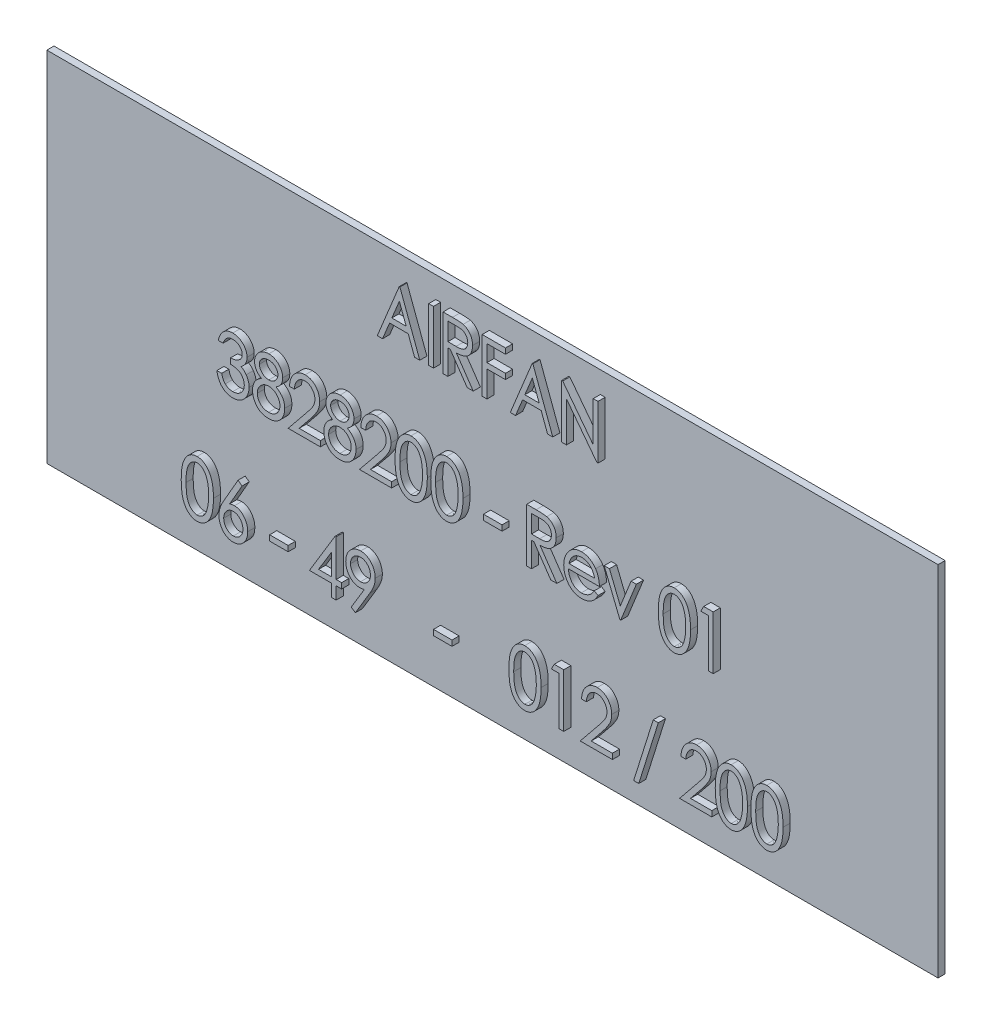
from build123d import *

# Parameters (mm, degrees)
ESQUISSE1_W      = 25
ESQUISSE1_H      = 10.042451621
EXTRUSION1_DEPTH = 0.2
ESQUISSE4_W      = 0.134615384
ESQUISSE4_H      = 1.5
ESQUISSE4_W_2    = 0.51923077
ESQUISSE4_H_2    = 0.153846154
EXTRUSION4_DEPTH = 0.2


with BuildPart() as part:
    # Esquisse1 → Extrusion1 (new body)
    with BuildSketch(Plane.XY):
        with Locations((-9.984409842, -7.856341036)):
            Rectangle(ESQUISSE1_W, ESQUISSE1_H)
    extrude(amount=EXTRUSION1_DEPTH)

    # Esquisse4 → Extrusion4 (add)
    # profile 1 of 32: a face of its own
    with BuildSketch(Plane.XY.offset(0.2)):
        Polygon((-12.3803848, -3.438062313), (-11.822692492, -4.938062313), (-11.968726146, -4.938062313), (-12.147211723, -4.457293082), (-12.6694473, -4.457293082), (-12.866562684, -4.938062313), (-13.015000184, -4.938062313), (-12.399615569, -3.438062313), align=None)
        Polygon((-12.395408838, -3.789925294), (-12.606045858, -4.303446928), (-12.20460355, -4.303446928), align=None, mode=Mode.SUBTRACT)
    # profile 2 of 32: a face of its own
    with BuildSketch(Plane.XY.offset(0.2)):
        with Locations((-11.5053848, -4.188062313)):
            Rectangle(ESQUISSE4_W, ESQUISSE4_H)
    # profile 3 of 32: a face of its own
    with BuildSketch(Plane.XY.offset(0.2)):
        with BuildLine():
            Line((-11.168846338, -3.438062313), (-10.905625184, -3.438062313))
            add(Edge.make_bspline(
                [(-10.905625184, -3.438062313), (-10.887997129, -3.438128238), (-10.854240871, -3.438254479), (-10.805846867, -3.438975348), (-10.761889574, -3.44101852), (-10.722284056, -3.442775265), (-10.687148639, -3.445997644), (-10.656431639, -3.44902296), (-10.6301402, -3.453146751), (-10.614242676, -3.456812701), (-10.6069473, -3.458495005)],
                knots=[0, 0, 0, 0, 1.410548186, 2.701082353, 3.872164956, 4.931545487, 5.872643019, 6.694846481, 7.4010648, 8, 8, 8, 8], degree=3))
            add(Edge.make_bspline(
                [(-10.6069473, -3.458495005), (-10.597369837, -3.461214978), (-10.578320333, -3.466624984), (-10.550973402, -3.47797811), (-10.524790314, -3.491122812), (-10.499958287, -3.506490401), (-10.476809067, -3.524317146), (-10.455095788, -3.544316404), (-10.434509701, -3.566345217), (-10.415542999, -3.590547417), (-10.397891242, -3.6163406), (-10.382985009, -3.64401151), (-10.37035227, -3.673094408), (-10.359602222, -3.703435494), (-10.35218108, -3.735457434), (-10.345786144, -3.768672072), (-10.342715659, -3.803489298), (-10.34219002, -3.82718082), (-10.341923261, -3.83920414)],
                knots=[0, 0, 0, 0, 0.953385732, 1.896277294, 2.832058144, 3.758936013, 4.690028676, 5.627530842, 6.585110904, 7.575978385, 8.571622722, 9.576661008, 10.582432364, 11.608427265, 12.656015072, 13.729146958, 14.84755428, 16, 16, 16, 16], degree=3))
            add(Edge.make_bspline(
                [(-10.341923261, -3.83920414), (-10.342575541, -3.859171547), (-10.343844955, -3.898030551), (-10.353211775, -3.954519853), (-10.369213987, -4.007237025), (-10.39140298, -4.055982631), (-10.419336168, -4.100130202), (-10.453042993, -4.138928481), (-10.492604635, -4.171457445), (-10.52955324, -4.19411581), (-10.56223484, -4.208621937), (-10.58901563, -4.218762018), (-10.618287506, -4.226558784), (-10.649625327, -4.233620514), (-10.683256951, -4.238904463), (-10.719153682, -4.242788308), (-10.757255293, -4.2452022), (-10.783426101, -4.245567322), (-10.796851146, -4.245754621)],
                knots=[0, 0, 0, 0, 1.376286419, 2.678420862, 3.934476393, 5.16434824, 6.359712899, 7.524467423, 8.691553218, 9.878209641, 10.499433377, 11.154907673, 11.850203166, 12.585724918, 13.369062201, 14.195702105, 15.074435089, 16, 16, 16, 16], degree=3))
            Line((-10.796851146, -4.245754621), (-10.322692492, -4.938062313))
            Line((-10.322692492, -4.938062313), (-10.493365569, -4.938062313))
            Line((-10.493365569, -4.938062313), (-10.967524223, -4.245754621))
            Line((-10.967524223, -4.245754621), (-11.034230954, -4.245754621))
            Line((-11.034230954, -4.245754621), (-11.034230954, -4.938062313))
            Line((-11.034230954, -4.938062313), (-11.168846338, -4.938062313))
            Line((-11.168846338, -4.938062313), (-11.168846338, -3.438062313))
        make_face()
        with BuildLine():
            Line((-11.034230954, -3.591908467), (-11.034230954, -4.091908467))
            Line((-11.034230954, -4.091908467), (-10.806767011, -4.094011832))
            add(Edge.make_bspline(
                [(-10.806767011, -4.094011832), (-10.796147209, -4.094016226), (-10.775496655, -4.094024771), (-10.745648918, -4.092320237), (-10.717871174, -4.090378137), (-10.692304489, -4.087370605), (-10.668913211, -4.083573347), (-10.647653929, -4.07870212), (-10.628511672, -4.073173224), (-10.606054663, -4.064342193), (-10.580895677, -4.050609245), (-10.553580026, -4.030517271), (-10.530712274, -4.005273371), (-10.511094537, -3.976710898), (-10.495695518, -3.945055308), (-10.484401169, -3.911240243), (-10.477653323, -3.875631937), (-10.476913415, -3.851252187), (-10.476538646, -3.838903659)],
                knots=[0, 0, 0, 0, 1.065336973, 2.071582586, 2.998846003, 3.85897903, 4.653684173, 5.375320294, 6.046259432, 6.650926192, 7.793083249, 8.91264409, 10.036257247, 11.193087795, 12.379657337, 13.555538771, 14.761861912, 16, 16, 16, 16], degree=3))
            add(Edge.make_bspline(
                [(-10.476538646, -3.838903659), (-10.476873059, -3.826845335), (-10.477533744, -3.803022266), (-10.484890019, -3.76833166), (-10.495790012, -3.735085138), (-10.512007015, -3.704483309), (-10.530731142, -3.676186585), (-10.55333162, -3.652220852), (-10.578492805, -3.63229286), (-10.602244598, -3.619504241), (-10.623467382, -3.61162034), (-10.641729317, -3.606255527), (-10.662407674, -3.601722288), (-10.685518466, -3.598309626), (-10.711056577, -3.595224134), (-10.739031122, -3.593212781), (-10.76939595, -3.591995127), (-10.790439598, -3.591938071), (-10.801358358, -3.591908467)],
                knots=[0, 0, 0, 0, 1.234327139, 2.438602754, 3.620607776, 4.81008266, 5.97781748, 7.089343407, 8.171889953, 9.256139727, 9.837835946, 10.490922354, 11.205974105, 12.006200778, 12.885051669, 13.842733138, 14.880675122, 16, 16, 16, 16], degree=3))
            Line((-10.801358358, -3.591908467), (-11.034230954, -3.591908467))
        make_face(mode=Mode.SUBTRACT)
    # profile 4 of 32: a face of its own
    with BuildSketch(Plane.XY.offset(0.2)):
        Polygon((-10.072692492, -3.438062313), (-9.418846338, -3.438062313), (-9.418846338, -3.591908467), (-9.938077108, -3.591908467), (-9.938077108, -4.053446928), (-9.418846338, -4.053446928), (-9.418846338, -4.207293082), (-9.938077108, -4.207293082), (-9.938077108, -4.938062313), (-10.072692492, -4.938062313), align=None)
    # profile 5 of 32: a face of its own
    with BuildSketch(Plane.XY.offset(0.2)):
        Polygon((-8.649615569, -3.438062313), (-8.091923261, -4.938062313), (-8.237956915, -4.938062313), (-8.416442492, -4.457293082), (-8.938678069, -4.457293082), (-9.135793454, -4.938062313), (-9.284230954, -4.938062313), (-8.668846338, -3.438062313), align=None)
        Polygon((-8.664639608, -3.789925294), (-8.875276627, -4.303446928), (-8.473834319, -4.303446928), align=None, mode=Mode.SUBTRACT)
    # profile 6 of 32: a face of its own
    with BuildSketch(Plane.XY.offset(0.2)):
        Polygon((-7.841923261, -4.938062313), (-7.841923261, -3.438062313), (-7.813678069, -3.438062313), (-6.957307877, -4.561559909), (-6.957307877, -3.438062313), (-6.822692492, -3.438062313), (-6.822692492, -4.938062313), (-6.853341531, -4.938062313), (-7.707307877, -3.817870005), (-7.707307877, -4.938062313), align=None)
    # profile 7 of 32: a face of its own
    with BuildSketch(Plane.XY.offset(0.2)):
        with BuildLine():
            Line((-17.341923261, -7.284216159), (-17.476538646, -7.284216159))
            add(Edge.make_bspline(
                [(-17.476538646, -7.284216159), (-17.473127691, -7.269142246), (-17.466478359, -7.239757083), (-17.45343385, -7.197380063), (-17.438154557, -7.157724556), (-17.420708449, -7.120655014), (-17.401234917, -7.086139301), (-17.379064771, -7.054559686), (-17.355224446, -7.025147857), (-17.328544568, -6.999223653), (-17.300778529, -6.975549874), (-17.271176201, -6.955552642), (-17.240628897, -6.938148607), (-17.208744356, -6.923984004), (-17.175479781, -6.913176653), (-17.140988714, -6.905365834), (-17.105290631, -6.900373631), (-17.081022235, -6.89985983), (-17.068786242, -6.899600775)],
                knots=[0, 0, 0, 0, 1.213646873, 2.365889363, 3.479226314, 4.54912843, 5.581579656, 6.587705624, 7.576924878, 8.55050232, 9.505464024, 10.439453725, 11.351887816, 12.264152294, 13.174752891, 14.094686289, 15.039351257, 16, 16, 16, 16], degree=3))
            add(Edge.make_bspline(
                [(-17.068786242, -6.899600775), (-17.050907172, -6.900197488), (-17.015450923, -6.90138084), (-16.963416327, -6.912041601), (-16.913266108, -6.929048463), (-16.865512355, -6.952382186), (-16.821149947, -6.981289322), (-16.781663245, -7.015521945), (-16.747748575, -7.054625478), (-16.719641205, -7.097944095), (-16.69726267, -7.143921096), (-16.680803897, -7.191386361), (-16.670803884, -7.240028807), (-16.669500445, -7.27285241), (-16.668846338, -7.289324332)],
                knots=[0, 0, 0, 0, 1.037475548, 2.057433109, 3.071083532, 4.106583696, 5.136003477, 6.138035553, 7.131860785, 8.132253496, 9.128731291, 10.094580144, 11.043800018, 12, 12, 12, 12], degree=3))
            add(Edge.make_bspline(
                [(-16.668846338, -7.289324332), (-16.66936514, -7.305182608), (-16.670379781, -7.336197245), (-16.678364702, -7.381454336), (-16.691603311, -7.424212375), (-16.710390824, -7.464389278), (-16.734399466, -7.502095156), (-16.763808501, -7.536994498), (-16.798337724, -7.569580104), (-16.824555315, -7.588304067), (-16.838017011, -7.597918082)],
                knots=[0, 0, 0, 0, 1.034740432, 2.023681557, 2.989439786, 3.948891607, 4.910213012, 5.898894732, 6.921165452, 8, 8, 8, 8], degree=3))
            add(Edge.make_bspline(
                [(-16.838017011, -7.597918082), (-16.823661147, -7.605659001), (-16.795002996, -7.62111195), (-16.7561728, -7.650983622), (-16.721044289, -7.68572864), (-16.701552503, -7.712411884), (-16.691682877, -7.72592289)],
                knots=[0, 0, 0, 0, 0.994457701, 1.985203988, 2.979812114, 4, 4, 4, 4], degree=3))
            add(Edge.make_bspline(
                [(-16.691682877, -7.72592289), (-16.685183874, -7.735827445), (-16.672241235, -7.755552176), (-16.656295762, -7.786937624), (-16.642237591, -7.818973505), (-16.630857559, -7.851925673), (-16.622130759, -7.885808311), (-16.615838897, -7.920550772), (-16.611762132, -7.956194117), (-16.611357492, -7.980318901), (-16.611154031, -7.992449332)],
                knots=[0, 0, 0, 0, 1.00515716, 2.001751025, 2.984458985, 3.97420733, 4.958128942, 5.952324961, 6.970387383, 8, 8, 8, 8], degree=3))
            add(Edge.make_bspline(
                [(-16.611154031, -7.992449332), (-16.61195472, -8.013427479), (-16.613548161, -8.055175831), (-16.624903616, -8.117163215), (-16.644419135, -8.177354635), (-16.670672697, -8.235411159), (-16.703324697, -8.289482977), (-16.742143388, -8.337884019), (-16.786628953, -8.379703168), (-16.836377444, -8.414539886), (-16.890258227, -8.442499028), (-16.947971349, -8.461824432), (-17.008639326, -8.474511343), (-17.050291485, -8.475845053), (-17.071490569, -8.476523852)],
                knots=[0, 0, 0, 0, 1.014707837, 2.019357588, 3.036907717, 4.069166202, 5.095504868, 6.084608755, 7.061626644, 8.038980938, 9.014218756, 9.987287233, 10.975619287, 12, 12, 12, 12], degree=3))
            add(Edge.make_bspline(
                [(-17.071490569, -8.476523852), (-17.085726145, -8.476154242), (-17.113689649, -8.475428204), (-17.154796999, -8.470397291), (-17.193973109, -8.461232934), (-17.231417188, -8.448929966), (-17.267169803, -8.433185391), (-17.301194056, -8.414001928), (-17.333238245, -8.390922938), (-17.363268563, -8.364402297), (-17.391335571, -8.334680501), (-17.416615564, -8.301326988), (-17.439492188, -8.264803984), (-17.45990759, -8.225105823), (-17.477678986, -8.182058867), (-17.492897838, -8.135858629), (-17.50561802, -8.086255182), (-17.511813772, -8.051889884), (-17.515000184, -8.034216159)],
                knots=[0, 0, 0, 0, 0.990513423, 1.945704551, 2.875515556, 3.785713825, 4.684393021, 5.589454026, 6.498450854, 7.426798081, 8.373433753, 9.338011181, 10.333830724, 11.368661367, 12.440314751, 13.570898844, 14.750737914, 16, 16, 16, 16], degree=3))
            Line((-17.515000184, -8.034216159), (-17.3803848, -8.034216159))
            add(Edge.make_bspline(
                [(-17.3803848, -8.034216159), (-17.377523151, -8.04577546), (-17.371958207, -8.068254412), (-17.361492387, -8.10030399), (-17.350989697, -8.130189432), (-17.338825546, -8.157305289), (-17.325950794, -8.182036973), (-17.312143395, -8.20444389), (-17.297262415, -8.224290106), (-17.286241598, -8.235932256), (-17.280925665, -8.24154789)],
                knots=[0, 0, 0, 0, 1.227409514, 2.386898646, 3.474821375, 4.49196229, 5.448190758, 6.348047463, 7.203174547, 8, 8, 8, 8], degree=3))
            add(Edge.make_bspline(
                [(-17.280925665, -8.24154789), (-17.27383394, -8.248003554), (-17.25978819, -8.26078953), (-17.236693854, -8.277334968), (-17.212414497, -8.291724948), (-17.186257005, -8.302559582), (-17.159157015, -8.311895135), (-17.130396319, -8.317985143), (-17.100257206, -8.322117601), (-17.079618363, -8.322488457), (-17.069086723, -8.322677698)],
                knots=[0, 0, 0, 0, 0.987786239, 1.956392453, 2.923291289, 3.889914458, 4.869410071, 5.873943724, 6.915110651, 8, 8, 8, 8], degree=3))
            add(Edge.make_bspline(
                [(-17.069086723, -8.322677698), (-17.057149134, -8.322420321), (-17.033885844, -8.321918759), (-16.99994241, -8.317096706), (-16.967678851, -8.310274395), (-16.937434882, -8.299370027), (-16.908610624, -8.286343744), (-16.881915797, -8.269673996), (-16.856986192, -8.250188429), (-16.834034213, -8.228129858), (-16.813536277, -8.203896242), (-16.795421848, -8.178588412), (-16.779824073, -8.152375775), (-16.767692528, -8.124804792), (-16.757490651, -8.096488359), (-16.750653536, -8.066940452), (-16.746766389, -8.036423712), (-16.746104191, -8.015797586), (-16.745769415, -8.005370005)],
                knots=[0, 0, 0, 0, 1.131388683, 2.204785482, 3.246441662, 4.252851856, 5.247356788, 6.241181003, 7.22926868, 8.243715995, 9.254465245, 10.235036049, 11.192984918, 12.141087045, 13.087426855, 14.043631555, 15.010953923, 16, 16, 16, 16], degree=3))
            add(Edge.make_bspline(
                [(-16.745769415, -8.005370005), (-16.74628171, -7.991407885), (-16.747300351, -7.963645781), (-16.755733263, -7.922801595), (-16.7693133, -7.883379357), (-16.788311005, -7.846006265), (-16.811464562, -7.811366612), (-16.838632484, -7.780538237), (-16.870029339, -7.754864773), (-16.899147024, -7.737007957), (-16.925024284, -7.725123674), (-16.946988933, -7.716966854), (-16.971501169, -7.710287778), (-16.998317526, -7.703850957), (-17.027819643, -7.698536028), (-17.059803492, -7.694118667), (-17.094274445, -7.690455815), (-17.118058196, -7.688879357), (-17.1303848, -7.688062313)],
                knots=[0, 0, 0, 0, 1.19277501, 2.371698767, 3.54972029, 4.748382554, 5.945391955, 7.103829679, 8.24739154, 9.400245482, 10.013276171, 10.679775806, 11.400814213, 12.18386578, 13.037095876, 13.962316118, 14.943912534, 16, 16, 16, 16], degree=3))
            Line((-17.1303848, -7.688062313), (-17.1303848, -7.534216159))
            add(Edge.make_bspline(
                [(-17.1303848, -7.534216159), (-17.114628343, -7.533892582), (-17.083657123, -7.533256551), (-17.038533368, -7.525867523), (-16.995273542, -7.51532953), (-16.95498758, -7.499701998), (-16.918250383, -7.481089552), (-16.886306395, -7.459856591), (-16.859978947, -7.435797951), (-16.838974354, -7.409362749), (-16.82302659, -7.381075268), (-16.811825165, -7.351363637), (-16.804482664, -7.320531735), (-16.803803829, -7.299382008), (-16.803461723, -7.288723371)],
                knots=[0, 0, 0, 0, 1.243740816, 2.444722913, 3.604071008, 4.756374622, 5.850061341, 6.853181308, 7.777365241, 8.656145985, 9.510167359, 10.331781837, 11.159283104, 12, 12, 12, 12], degree=3))
            add(Edge.make_bspline(
                [(-16.803461723, -7.288723371), (-16.803686365, -7.280896413), (-16.804132309, -7.265358841), (-16.807872475, -7.242611883), (-16.813651232, -7.220559439), (-16.82163567, -7.199313684), (-16.832411789, -7.178957), (-16.845317343, -7.159369027), (-16.860758178, -7.140761983), (-16.878193122, -7.123132646), (-16.897106442, -7.106551322), (-16.917985075, -7.092594198), (-16.939802956, -7.080324073), (-16.962874684, -7.070470235), (-16.987251941, -7.06288674), (-17.012812208, -7.057560478), (-17.0396498, -7.054167081), (-17.057958664, -7.053689946), (-17.067283838, -7.053446928)],
                knots=[0, 0, 0, 0, 0.954298075, 1.894410913, 2.804261135, 3.732387345, 4.655998667, 5.60826082, 6.589174048, 7.600068601, 8.631142096, 9.651225118, 10.65760524, 11.681194716, 12.705294547, 13.766901717, 14.862625692, 16, 16, 16, 16], degree=3))
            add(Edge.make_bspline(
                [(-17.067283838, -7.053446928), (-17.08226782, -7.054042021), (-17.11157969, -7.055206149), (-17.153806403, -7.065505231), (-17.193041805, -7.081838271), (-17.222853239, -7.101263179), (-17.244722215, -7.120464812), (-17.260689345, -7.136981922), (-17.275838372, -7.155974681), (-17.290477847, -7.177114431), (-17.304159806, -7.200806343), (-17.317871051, -7.226286189), (-17.330411209, -7.254376388), (-17.338006734, -7.274064341), (-17.341923261, -7.284216159)],
                knots=[0, 0, 0, 0, 1.395445339, 2.729789254, 4.027341734, 5.343352216, 6.025171276, 6.738565338, 7.482488129, 8.288221053, 9.133992859, 10.032284056, 10.985374711, 12, 12, 12, 12], degree=3))
        make_face()
    # profile 8 of 32: a face of its own
    with BuildSketch(Plane.XY.offset(0.2)):
        with BuildLine():
            add(Edge.make_bspline(
                [(-15.856346338, -7.602425294), (-15.845554182, -7.608815437), (-15.824528623, -7.62126488), (-15.794862456, -7.641588442), (-15.767700152, -7.662591947), (-15.742470147, -7.683785536), (-15.720172106, -7.706288265), (-15.700092276, -7.729195923), (-15.682440233, -7.752932874), (-15.662119542, -7.785239376), (-15.641397044, -7.82801719), (-15.62396561, -7.882757166), (-15.613175406, -7.940844471), (-15.611836992, -7.980783399), (-15.611154031, -8.001163275)],
                knots=[0, 0, 0, 0, 0.914362454, 1.781384597, 2.619883779, 3.417600481, 4.181920405, 4.927374046, 5.637276055, 6.336350791, 7.708254165, 9.089438062, 10.514810145, 12, 12, 12, 12], degree=3))
            add(Edge.make_bspline(
                [(-15.611154031, -8.001163275), (-15.6114053, -8.01560171), (-15.611902301, -8.044160379), (-15.61699242, -8.086326101), (-15.624572424, -8.127289349), (-15.635962996, -8.166893264), (-15.649869373, -8.205275609), (-15.667315044, -8.24228328), (-15.687517306, -8.278166926), (-15.703683795, -8.300584817), (-15.711815088, -8.31186039)],
                knots=[0, 0, 0, 0, 1.041882803, 2.060804048, 3.06202158, 4.046332822, 5.03231592, 6.006025776, 6.99708666, 8, 8, 8, 8], degree=3))
            add(Edge.make_bspline(
                [(-15.711815088, -8.31186039), (-15.722320406, -8.324961704), (-15.743122216, -8.350903904), (-15.779432189, -8.384495028), (-15.818850336, -8.413100311), (-15.861649265, -8.436474158), (-15.907845651, -8.454407486), (-15.957303935, -8.467480245), (-16.010068927, -8.474882888), (-16.046327773, -8.475968425), (-16.064879992, -8.476523852)],
                knots=[0, 0, 0, 0, 0.994201578, 1.968640301, 2.92098468, 3.874697238, 4.850310626, 5.851048309, 6.900466311, 8, 8, 8, 8], degree=3))
            add(Edge.make_bspline(
                [(-16.064879992, -8.476523852), (-16.082827448, -8.476035351), (-16.117647006, -8.475087621), (-16.168336129, -8.468526445), (-16.215522613, -8.457065512), (-16.259635118, -8.441544815), (-16.30017376, -8.420930401), (-16.337312101, -8.395789357), (-16.371448234, -8.366450673), (-16.401348764, -8.332472768), (-16.427800558, -8.295997821), (-16.450995098, -8.258271799), (-16.471087389, -8.219863839), (-16.4868774, -8.180197767), (-16.499807611, -8.139915923), (-16.508265964, -8.098489002), (-16.514010626, -8.05631219), (-16.514668809, -8.027825305), (-16.515000184, -8.013482986)],
                knots=[0, 0, 0, 0, 1.189830096, 2.308369381, 3.38102576, 4.403937896, 5.401777142, 6.387120394, 7.37100814, 8.377427796, 9.380226239, 10.35513181, 11.31145126, 12.249850496, 13.182357426, 14.112259914, 15.049577746, 16, 16, 16, 16], degree=3))
            add(Edge.make_bspline(
                [(-16.515000184, -8.013482986), (-16.514309623, -7.992705677), (-16.512955966, -7.951977457), (-16.502244715, -7.892543195), (-16.484339854, -7.836440272), (-16.463711156, -7.792218513), (-16.443474426, -7.758476682), (-16.425205229, -7.734150342), (-16.404722962, -7.710362739), (-16.381777595, -7.687123543), (-16.356256873, -7.664660875), (-16.328097086, -7.642974703), (-16.297552942, -7.621918382), (-16.275796938, -7.609009709), (-16.264699704, -7.602425294)],
                knots=[0, 0, 0, 0, 1.473281155, 2.887963909, 4.267687182, 5.640863319, 6.339108383, 7.055342466, 7.795973019, 8.564700607, 9.370150118, 10.205839621, 11.084840353, 12, 12, 12, 12], degree=3))
            add(Edge.make_bspline(
                [(-16.264699704, -7.602425294), (-16.279987327, -7.592881467), (-16.309880249, -7.574219779), (-16.349252692, -7.540621264), (-16.382972926, -7.503967046), (-16.409972815, -7.463794408), (-16.431100631, -7.421315619), (-16.44622255, -7.377074047), (-16.455619648, -7.331286941), (-16.456742277, -7.300185892), (-16.457307877, -7.28451664)],
                knots=[0, 0, 0, 0, 1.108078529, 2.1667008, 3.174911676, 4.165013377, 5.13557244, 6.087046531, 7.036220656, 8, 8, 8, 8], degree=3))
            add(Edge.make_bspline(
                [(-16.457307877, -7.28451664), (-16.456674384, -7.268538603), (-16.455403222, -7.236477202), (-16.444892694, -7.188796287), (-16.428372832, -7.141701416), (-16.405073973, -7.096045197), (-16.376820997, -7.052509354), (-16.342065273, -7.014004382), (-16.302946907, -6.979736007), (-16.258810478, -6.95121484), (-16.211442495, -6.92805508), (-16.161459103, -6.911809419), (-16.109780458, -6.901434125), (-16.074544633, -6.900215574), (-16.056767011, -6.899600775)],
                knots=[0, 0, 0, 0, 0.933393775, 1.872940412, 2.841657425, 3.844761966, 4.863186887, 5.867009188, 6.867494675, 7.895706246, 8.930319001, 9.941494413, 10.961416858, 12, 12, 12, 12], degree=3))
            add(Edge.make_bspline(
                [(-16.056767011, -6.899600775), (-16.039392212, -6.900222047), (-16.00505366, -6.901449893), (-15.954548975, -6.911701427), (-15.906229936, -6.928702913), (-15.860317549, -6.951880206), (-15.817630786, -6.980452671), (-15.779890872, -7.014827325), (-15.746744249, -7.053618557), (-15.719092988, -7.096689783), (-15.696905243, -7.142637518), (-15.68040346, -7.190151633), (-15.670900668, -7.239168107), (-15.669533065, -7.272157903), (-15.668846338, -7.288723371)],
                knots=[0, 0, 0, 0, 1.025177658, 2.026102131, 3.028615222, 4.041574873, 5.055259337, 6.051788893, 7.046052148, 8.059822865, 9.064931678, 10.052400243, 11.022033903, 12, 12, 12, 12], degree=3))
            add(Edge.make_bspline(
                [(-15.668846338, -7.288723371), (-15.669425099, -7.3049881), (-15.670559142, -7.336857759), (-15.679435322, -7.383309941), (-15.694285853, -7.426957027), (-15.714892728, -7.467994979), (-15.741575665, -7.506095343), (-15.774408802, -7.541197097), (-15.812473051, -7.574218652), (-15.841467798, -7.592859709), (-15.856346338, -7.602425294)],
                knots=[0, 0, 0, 0, 1.017158402, 1.993054549, 2.946292347, 3.893578809, 4.856714948, 5.845702908, 6.894530941, 8, 8, 8, 8], degree=3))
        make_face()
        with BuildLine():
            add(Edge.make_bspline(
                [(-16.063678069, -7.053446928), (-16.072798393, -7.053726521), (-16.090687092, -7.054274917), (-16.116981733, -7.05714519), (-16.14198595, -7.062681194), (-16.165945341, -7.070048641), (-16.188473953, -7.080277759), (-16.210301703, -7.091724338), (-16.230454742, -7.106126543), (-16.249298213, -7.122185232), (-16.26618955, -7.139869678), (-16.281463315, -7.158148902), (-16.294091376, -7.177591303), (-16.304754571, -7.197735616), (-16.312840463, -7.218837185), (-16.318633387, -7.240688335), (-16.321945048, -7.263381474), (-16.322440874, -7.278797033), (-16.322692492, -7.286620005)],
                knots=[0, 0, 0, 0, 1.128425343, 2.213305224, 3.265437279, 4.291949646, 5.307035918, 6.32144161, 7.335317645, 8.363249344, 9.379544413, 10.356652003, 11.304985507, 12.241430786, 13.170884807, 14.093377769, 15.032441564, 16, 16, 16, 16], degree=3))
            add(Edge.make_bspline(
                [(-16.322692492, -7.286620005), (-16.322465524, -7.294445815), (-16.322017832, -7.309882149), (-16.31830729, -7.332793094), (-16.311928896, -7.355024057), (-16.30318113, -7.376787471), (-16.291872541, -7.397945854), (-16.278449704, -7.418676673), (-16.262220402, -7.438692087), (-16.24389123, -7.457841507), (-16.223999806, -7.475749169), (-16.202986471, -7.491534347), (-16.180778151, -7.504441722), (-16.158006409, -7.515323727), (-16.134362247, -7.523837419), (-16.109892408, -7.529825261), (-16.084625109, -7.533534918), (-16.067496708, -7.533987983), (-16.058870377, -7.534216159)],
                knots=[0, 0, 0, 0, 0.941109226, 1.856328975, 2.783214069, 3.718519893, 4.672576731, 5.66519449, 6.685154655, 7.767547646, 8.851281227, 9.90202341, 10.922908451, 11.936227576, 12.934824575, 13.940159871, 14.962608181, 16, 16, 16, 16], degree=3))
            add(Edge.make_bspline(
                [(-16.058870377, -7.534216159), (-16.047718844, -7.533841333), (-16.025516298, -7.533095059), (-15.992879855, -7.526169038), (-15.96122834, -7.515177237), (-15.930784185, -7.500264865), (-15.902305561, -7.481588685), (-15.877225876, -7.458933833), (-15.854930555, -7.433667888), (-15.836875174, -7.40506641), (-15.822456097, -7.375115872), (-15.811229898, -7.344843285), (-15.804733009, -7.314241347), (-15.803882826, -7.293759859), (-15.803461723, -7.283615198)],
                knots=[0, 0, 0, 0, 1.013084994, 2.017038092, 3.019502504, 4.054223377, 5.092546353, 6.10542658, 7.119125627, 8.147492291, 9.170033384, 10.138140416, 11.077804571, 12, 12, 12, 12], degree=3))
            add(Edge.make_bspline(
                [(-15.803461723, -7.283615198), (-15.804292059, -7.269507603), (-15.805949391, -7.241349183), (-15.81885391, -7.200109107), (-15.840676808, -7.161311496), (-15.864377484, -7.130764246), (-15.887575919, -7.108782157), (-15.907040326, -7.093687124), (-15.928642242, -7.081273015), (-15.952059538, -7.070821772), (-15.977356053, -7.063254455), (-16.004451731, -7.057351069), (-16.03345571, -7.05420356), (-16.053455174, -7.053702864), (-16.063678069, -7.053446928)],
                knots=[0, 0, 0, 0, 1.307320902, 2.609381067, 3.96494532, 5.420448181, 6.176278048, 6.925223031, 7.699726536, 8.48182856, 9.298861196, 10.144453644, 11.051521825, 12, 12, 12, 12], degree=3))
        make_face(mode=Mode.SUBTRACT)
        with BuildLine():
            add(Edge.make_bspline(
                [(-16.05616605, -7.688062313), (-16.067404862, -7.68830685), (-16.089588484, -7.688789526), (-16.122036651, -7.693933271), (-16.153253743, -7.701200041), (-16.18296421, -7.712204414), (-16.211249398, -7.726357213), (-16.238158041, -7.743687891), (-16.263781044, -7.763843051), (-16.287602115, -7.786912476), (-16.309293945, -7.811863773), (-16.328447044, -7.838124077), (-16.344390686, -7.865539879), (-16.357432894, -7.894039395), (-16.367585161, -7.923544156), (-16.375330328, -7.954050205), (-16.379431286, -7.985726251), (-16.380064805, -8.007162559), (-16.3803848, -8.017990198)],
                knots=[0, 0, 0, 0, 1.048421666, 2.069416987, 3.060597679, 4.036932712, 5.019740262, 6.008093548, 7.02022806, 8.058591887, 9.099311237, 10.103813435, 11.088621048, 12.055279132, 13.02532386, 13.998339084, 14.988946113, 16, 16, 16, 16], degree=3))
            add(Edge.make_bspline(
                [(-16.3803848, -8.017990198), (-16.379971233, -8.031452079), (-16.379152845, -8.058091195), (-16.37108033, -8.097400354), (-16.358984945, -8.135679982), (-16.341379424, -8.172231334), (-16.319884078, -8.206375433), (-16.293467912, -8.236565543), (-16.26344828, -8.262814581), (-16.229395689, -8.284584988), (-16.192107612, -8.301792171), (-16.151676066, -8.313584188), (-16.108659106, -8.32151689), (-16.078940016, -8.322283839), (-16.063678069, -8.322677698)],
                knots=[0, 0, 0, 0, 0.983353418, 1.945914075, 2.923520839, 3.913075695, 4.904716137, 5.865351531, 6.836321414, 7.811675056, 8.811399656, 9.82878879, 10.884995781, 12, 12, 12, 12], degree=3))
            add(Edge.make_bspline(
                [(-16.063678069, -8.322677698), (-16.051845321, -8.322395), (-16.028592062, -8.321839454), (-15.994759912, -8.317323598), (-15.962751493, -8.309748823), (-15.932752266, -8.299250416), (-15.90434766, -8.285926165), (-15.878042285, -8.26945577), (-15.853569971, -8.249863973), (-15.83141996, -8.227508828), (-15.811324218, -8.203255228), (-15.793850378, -8.17768086), (-15.779126843, -8.151056947), (-15.76661072, -8.123746054), (-15.757256254, -8.095198595), (-15.750820603, -8.065684412), (-15.746258962, -8.035158189), (-15.745934224, -8.014401742), (-15.745769415, -8.003867602)],
                knots=[0, 0, 0, 0, 1.127389244, 2.215501698, 3.245805524, 4.257141659, 5.239223727, 6.229804829, 7.207749447, 8.220211165, 9.223632865, 10.205900477, 11.167354178, 12.120096853, 13.064916475, 14.023665393, 14.996987016, 16, 16, 16, 16], degree=3))
            add(Edge.make_bspline(
                [(-15.745769415, -8.003867602), (-15.746073828, -7.993637285), (-15.74667333, -7.973489958), (-15.750977143, -7.943672197), (-15.758232369, -7.914815115), (-15.76819879, -7.886746309), (-15.780854071, -7.859510351), (-15.796595286, -7.833252853), (-15.815363269, -7.808033073), (-15.836510253, -7.783856339), (-15.859629946, -7.761639707), (-15.884094814, -7.741764467), (-15.90999278, -7.725323406), (-15.936914338, -7.71160611), (-15.965036741, -7.701038017), (-15.994351768, -7.693541209), (-16.024867558, -7.688891814), (-16.045632641, -7.688341479), (-16.05616605, -7.688062313)],
                knots=[0, 0, 0, 0, 1.001088024, 1.971517479, 2.94155076, 3.908905619, 4.882498667, 5.876071198, 6.899515427, 7.955402232, 9.016146846, 10.034225051, 11.034929039, 12.012560479, 12.98664691, 13.968593758, 14.969537786, 16, 16, 16, 16], degree=3))
        make_face(mode=Mode.SUBTRACT)
    # profile 9 of 32: a face of its own
    with BuildSketch(Plane.XY.offset(0.2)):
        with BuildLine():
            Line((-15.341923261, -7.399600775), (-15.476538646, -7.399600775))
            add(Edge.make_bspline(
                [(-15.476538646, -7.399600775), (-15.475712424, -7.381749165), (-15.474091442, -7.346725693), (-15.467027071, -7.295601945), (-15.456712364, -7.246742673), (-15.441810677, -7.200612965), (-15.423792743, -7.156559365), (-15.401830583, -7.115114143), (-15.376146425, -7.076014199), (-15.34677249, -7.039953495), (-15.314921342, -7.007032077), (-15.28081738, -6.978131969), (-15.244552237, -6.954172611), (-15.20677262, -6.93392187), (-15.166912921, -6.918758556), (-15.12538885, -6.9074476), (-15.081928131, -6.900709028), (-15.052283275, -6.899973913), (-15.037235761, -6.899600775)],
                knots=[0, 0, 0, 0, 1.157388701, 2.270706855, 3.339969662, 4.388770879, 5.407173851, 6.420352507, 7.422937862, 8.433452555, 9.429357235, 10.387433346, 11.323406098, 12.240766834, 13.159137072, 14.080094821, 15.025470071, 16, 16, 16, 16], degree=3))
            add(Edge.make_bspline(
                [(-15.037235761, -6.899600775), (-15.0223891, -6.899985172), (-14.99335704, -6.900736847), (-14.950932331, -6.907203246), (-14.910787918, -6.917790471), (-14.872526573, -6.932137298), (-14.836602068, -6.95129651), (-14.802881275, -6.974528893), (-14.771227353, -7.001838264), (-14.742564163, -7.033338336), (-14.716232661, -7.067250719), (-14.693375908, -7.103247221), (-14.673597221, -7.140479565), (-14.658052692, -7.179563428), (-14.645702321, -7.219964749), (-14.636541501, -7.261835143), (-14.631490919, -7.30532526), (-14.630756934, -7.334784818), (-14.6303848, -7.349720967)],
                knots=[0, 0, 0, 0, 1.051800275, 2.056753934, 3.03304212, 3.990199343, 4.946039437, 5.910878896, 6.887218698, 7.901977988, 8.924307075, 9.926649808, 10.920510366, 11.907859407, 12.902632229, 13.912088839, 14.94141816, 16, 16, 16, 16], degree=3))
            add(Edge.make_bspline(
                [(-14.6303848, -7.349720967), (-14.631003754, -7.370794305), (-14.632228053, -7.412477689), (-14.642492066, -7.4738675), (-14.659082117, -7.533215958), (-14.678606968, -7.581341133), (-14.698380239, -7.620236489), (-14.716361782, -7.651898494), (-14.737631728, -7.685930856), (-14.76167892, -7.72266518), (-14.788922822, -7.761850044), (-14.819513411, -7.803350208), (-14.852727865, -7.847613463), (-14.876503609, -7.877523465), (-14.888798261, -7.892990198)],
                knots=[0, 0, 0, 0, 1.233482511, 2.439847245, 3.633928361, 4.836450955, 5.473897344, 6.188356043, 6.968050959, 7.823797873, 8.759406765, 9.762507455, 10.842972314, 12, 12, 12, 12], degree=3))
            Line((-14.888798261, -7.892990198), (-15.206706915, -8.284216159))
            Line((-15.206706915, -8.284216159), (-14.611154031, -8.284216159))
            Line((-14.611154031, -8.284216159), (-14.611154031, -8.438062313))
            Line((-14.611154031, -8.438062313), (-15.515000184, -8.438062313))
            Line((-15.515000184, -8.438062313), (-15.010793454, -7.817269044))
            add(Edge.make_bspline(
                [(-15.010793454, -7.817269044), (-14.998537615, -7.802475181), (-14.974965264, -7.774021303), (-14.941593832, -7.732561723), (-14.911560945, -7.694084573), (-14.884604375, -7.658743768), (-14.861663855, -7.625964373), (-14.841548366, -7.596488541), (-14.825049205, -7.56979666), (-14.80736225, -7.538431639), (-14.790457887, -7.500207748), (-14.775396035, -7.453878731), (-14.766864443, -7.406023342), (-14.765625238, -7.373791285), (-14.765000184, -7.357533467)],
                knots=[0, 0, 0, 0, 1.297809128, 2.496150027, 3.595226863, 4.595304601, 5.498308645, 6.297775467, 7.005697546, 7.617561311, 8.729167951, 9.822669443, 10.901756619, 12, 12, 12, 12], degree=3))
            add(Edge.make_bspline(
                [(-14.765000184, -7.357533467), (-14.765195888, -7.347303407), (-14.765581121, -7.327165979), (-14.769675231, -7.297611699), (-14.775990072, -7.269165), (-14.784683475, -7.24164402), (-14.796092331, -7.215288151), (-14.810074211, -7.190019842), (-14.826748244, -7.166012339), (-14.845391563, -7.143060616), (-14.866031332, -7.122153202), (-14.887935248, -7.103638869), (-14.911245324, -7.088335442), (-14.935523012, -7.075467651), (-14.961030599, -7.065553019), (-14.987674695, -7.058713447), (-15.015355759, -7.054312282), (-15.034213889, -7.053739498), (-15.043846338, -7.053446928)],
                knots=[0, 0, 0, 0, 1.06989504, 2.106041779, 3.115552866, 4.11659498, 5.121251965, 6.115853611, 7.133385419, 8.176137438, 9.206329872, 10.203413544, 11.171427972, 12.118447235, 13.074126855, 14.027447124, 14.992449553, 16, 16, 16, 16], degree=3))
            add(Edge.make_bspline(
                [(-15.043846338, -7.053446928), (-15.053876403, -7.053753313), (-15.073625041, -7.054356566), (-15.102656231, -7.05860239), (-15.13035556, -7.065803817), (-15.15676756, -7.075935041), (-15.18208598, -7.088319038), (-15.205761466, -7.104390018), (-15.228269317, -7.12293456), (-15.249257428, -7.14432572), (-15.268582007, -7.16810038), (-15.2857184, -7.194415577), (-15.300795496, -7.222952846), (-15.313270313, -7.253962189), (-15.324384838, -7.286955828), (-15.332035824, -7.322597041), (-15.338715829, -7.360242242), (-15.340835443, -7.386252113), (-15.341923261, -7.399600775)],
                knots=[0, 0, 0, 0, 0.947670143, 1.865909634, 2.765819934, 3.646511421, 4.53540404, 5.422682691, 6.343698459, 7.287389961, 8.249693905, 9.234132192, 10.250229907, 11.294287865, 12.389763132, 13.535482573, 14.735172158, 16, 16, 16, 16], degree=3))
        make_face()
    # profile 10 of 32: a face of its own
    with BuildSketch(Plane.XY.offset(0.2)):
        with BuildLine():
            add(Edge.make_bspline(
                [(-13.856346338, -7.602425294), (-13.845554182, -7.608815437), (-13.824528623, -7.62126488), (-13.794862456, -7.641588442), (-13.767700152, -7.662591947), (-13.742470147, -7.683785536), (-13.720172106, -7.706288265), (-13.700092276, -7.729195923), (-13.682440233, -7.752932874), (-13.662119542, -7.785239376), (-13.641397044, -7.82801719), (-13.62396561, -7.882757166), (-13.613175406, -7.940844471), (-13.611836992, -7.980783399), (-13.611154031, -8.001163275)],
                knots=[0, 0, 0, 0, 0.914362454, 1.781384597, 2.619883779, 3.417600481, 4.181920405, 4.927374046, 5.637276055, 6.336350791, 7.708254165, 9.089438062, 10.514810145, 12, 12, 12, 12], degree=3))
            add(Edge.make_bspline(
                [(-13.611154031, -8.001163275), (-13.6114053, -8.01560171), (-13.611902301, -8.044160379), (-13.61699242, -8.086326101), (-13.624572424, -8.127289349), (-13.635962996, -8.166893264), (-13.649869373, -8.205275609), (-13.667315044, -8.24228328), (-13.687517306, -8.278166926), (-13.703683795, -8.300584817), (-13.711815088, -8.31186039)],
                knots=[0, 0, 0, 0, 1.041882803, 2.060804048, 3.06202158, 4.046332822, 5.03231592, 6.006025776, 6.99708666, 8, 8, 8, 8], degree=3))
            add(Edge.make_bspline(
                [(-13.711815088, -8.31186039), (-13.722320406, -8.324961704), (-13.743122216, -8.350903904), (-13.779432189, -8.384495028), (-13.818850336, -8.413100311), (-13.861649265, -8.436474158), (-13.907845651, -8.454407486), (-13.957303935, -8.467480245), (-14.010068927, -8.474882888), (-14.046327773, -8.475968425), (-14.064879992, -8.476523852)],
                knots=[0, 0, 0, 0, 0.994201578, 1.968640301, 2.92098468, 3.874697238, 4.850310626, 5.851048309, 6.900466311, 8, 8, 8, 8], degree=3))
            add(Edge.make_bspline(
                [(-14.064879992, -8.476523852), (-14.082827448, -8.476035351), (-14.117647006, -8.475087621), (-14.168336129, -8.468526445), (-14.215522613, -8.457065512), (-14.259635118, -8.441544815), (-14.30017376, -8.420930401), (-14.337312101, -8.395789357), (-14.371448234, -8.366450673), (-14.401348764, -8.332472768), (-14.427800558, -8.295997821), (-14.450995098, -8.258271799), (-14.471087389, -8.219863839), (-14.4868774, -8.180197767), (-14.499807611, -8.139915923), (-14.508265964, -8.098489002), (-14.514010626, -8.05631219), (-14.514668809, -8.027825305), (-14.515000184, -8.013482986)],
                knots=[0, 0, 0, 0, 1.189830096, 2.308369381, 3.38102576, 4.403937896, 5.401777142, 6.387120394, 7.37100814, 8.377427796, 9.380226239, 10.35513181, 11.31145126, 12.249850496, 13.182357426, 14.112259914, 15.049577746, 16, 16, 16, 16], degree=3))
            add(Edge.make_bspline(
                [(-14.515000184, -8.013482986), (-14.514309623, -7.992705677), (-14.512955966, -7.951977457), (-14.502244715, -7.892543195), (-14.484339854, -7.836440272), (-14.463711156, -7.792218513), (-14.443474426, -7.758476682), (-14.425205229, -7.734150342), (-14.404722962, -7.710362739), (-14.381777595, -7.687123543), (-14.356256873, -7.664660875), (-14.328097086, -7.642974703), (-14.297552942, -7.621918382), (-14.275796938, -7.609009709), (-14.264699704, -7.602425294)],
                knots=[0, 0, 0, 0, 1.473281155, 2.887963909, 4.267687182, 5.640863319, 6.339108383, 7.055342466, 7.795973019, 8.564700607, 9.370150118, 10.205839621, 11.084840353, 12, 12, 12, 12], degree=3))
            add(Edge.make_bspline(
                [(-14.264699704, -7.602425294), (-14.279987327, -7.592881467), (-14.309880249, -7.574219779), (-14.349252692, -7.540621264), (-14.382972926, -7.503967046), (-14.409972815, -7.463794408), (-14.431100631, -7.421315619), (-14.44622255, -7.377074047), (-14.455619648, -7.331286941), (-14.456742277, -7.300185892), (-14.457307877, -7.28451664)],
                knots=[0, 0, 0, 0, 1.108078529, 2.1667008, 3.174911676, 4.165013377, 5.13557244, 6.087046531, 7.036220656, 8, 8, 8, 8], degree=3))
            add(Edge.make_bspline(
                [(-14.457307877, -7.28451664), (-14.456674384, -7.268538603), (-14.455403222, -7.236477202), (-14.444892694, -7.188796287), (-14.428372832, -7.141701416), (-14.405073973, -7.096045197), (-14.376820997, -7.052509354), (-14.342065273, -7.014004382), (-14.302946907, -6.979736007), (-14.258810478, -6.95121484), (-14.211442495, -6.92805508), (-14.161459103, -6.911809419), (-14.109780458, -6.901434125), (-14.074544633, -6.900215574), (-14.056767011, -6.899600775)],
                knots=[0, 0, 0, 0, 0.933393775, 1.872940412, 2.841657425, 3.844761966, 4.863186887, 5.867009188, 6.867494675, 7.895706246, 8.930319001, 9.941494413, 10.961416858, 12, 12, 12, 12], degree=3))
            add(Edge.make_bspline(
                [(-14.056767011, -6.899600775), (-14.039392212, -6.900222047), (-14.00505366, -6.901449893), (-13.954548975, -6.911701427), (-13.906229936, -6.928702913), (-13.860317549, -6.951880206), (-13.817630786, -6.980452671), (-13.779890872, -7.014827325), (-13.746744249, -7.053618557), (-13.719092988, -7.096689783), (-13.696905243, -7.142637518), (-13.68040346, -7.190151633), (-13.670900668, -7.239168107), (-13.669533065, -7.272157903), (-13.668846338, -7.288723371)],
                knots=[0, 0, 0, 0, 1.025177658, 2.026102131, 3.028615222, 4.041574873, 5.055259337, 6.051788893, 7.046052148, 8.059822865, 9.064931678, 10.052400243, 11.022033903, 12, 12, 12, 12], degree=3))
            add(Edge.make_bspline(
                [(-13.668846338, -7.288723371), (-13.669425099, -7.3049881), (-13.670559142, -7.336857759), (-13.679435322, -7.383309941), (-13.694285853, -7.426957027), (-13.714892728, -7.467994979), (-13.741575665, -7.506095343), (-13.774408802, -7.541197097), (-13.812473051, -7.574218652), (-13.841467798, -7.592859709), (-13.856346338, -7.602425294)],
                knots=[0, 0, 0, 0, 1.017158402, 1.993054549, 2.946292347, 3.893578809, 4.856714948, 5.845702908, 6.894530941, 8, 8, 8, 8], degree=3))
        make_face()
        with BuildLine():
            add(Edge.make_bspline(
                [(-14.063678069, -7.053446928), (-14.072798393, -7.053726521), (-14.090687092, -7.054274917), (-14.116981733, -7.05714519), (-14.14198595, -7.062681194), (-14.165945341, -7.070048641), (-14.188473953, -7.080277759), (-14.210301703, -7.091724338), (-14.230454742, -7.106126543), (-14.249298213, -7.122185232), (-14.26618955, -7.139869678), (-14.281463315, -7.158148902), (-14.294091376, -7.177591303), (-14.304754571, -7.197735616), (-14.312840463, -7.218837185), (-14.318633387, -7.240688335), (-14.321945048, -7.263381474), (-14.322440874, -7.278797033), (-14.322692492, -7.286620005)],
                knots=[0, 0, 0, 0, 1.128425343, 2.213305224, 3.265437279, 4.291949646, 5.307035918, 6.32144161, 7.335317645, 8.363249344, 9.379544413, 10.356652003, 11.304985507, 12.241430786, 13.170884807, 14.093377769, 15.032441564, 16, 16, 16, 16], degree=3))
            add(Edge.make_bspline(
                [(-14.322692492, -7.286620005), (-14.322465524, -7.294445815), (-14.322017832, -7.309882149), (-14.31830729, -7.332793094), (-14.311928896, -7.355024057), (-14.30318113, -7.376787471), (-14.291872541, -7.397945854), (-14.278449704, -7.418676673), (-14.262220402, -7.438692087), (-14.24389123, -7.457841507), (-14.223999806, -7.475749169), (-14.202986471, -7.491534347), (-14.180778151, -7.504441722), (-14.158006409, -7.515323727), (-14.134362247, -7.523837419), (-14.109892408, -7.529825261), (-14.084625109, -7.533534918), (-14.067496708, -7.533987983), (-14.058870377, -7.534216159)],
                knots=[0, 0, 0, 0, 0.941109226, 1.856328975, 2.783214069, 3.718519893, 4.672576731, 5.66519449, 6.685154655, 7.767547646, 8.851281227, 9.90202341, 10.922908451, 11.936227576, 12.934824575, 13.940159871, 14.962608181, 16, 16, 16, 16], degree=3))
            add(Edge.make_bspline(
                [(-14.058870377, -7.534216159), (-14.047718844, -7.533841333), (-14.025516298, -7.533095059), (-13.992879855, -7.526169038), (-13.96122834, -7.515177237), (-13.930784185, -7.500264865), (-13.902305561, -7.481588685), (-13.877225876, -7.458933833), (-13.854930555, -7.433667888), (-13.836875174, -7.40506641), (-13.822456097, -7.375115872), (-13.811229898, -7.344843285), (-13.804733009, -7.314241347), (-13.803882826, -7.293759859), (-13.803461723, -7.283615198)],
                knots=[0, 0, 0, 0, 1.013084994, 2.017038092, 3.019502504, 4.054223377, 5.092546353, 6.10542658, 7.119125627, 8.147492291, 9.170033384, 10.138140416, 11.077804571, 12, 12, 12, 12], degree=3))
            add(Edge.make_bspline(
                [(-13.803461723, -7.283615198), (-13.804292059, -7.269507603), (-13.805949391, -7.241349183), (-13.81885391, -7.200109107), (-13.840676808, -7.161311496), (-13.864377484, -7.130764246), (-13.887575919, -7.108782157), (-13.907040326, -7.093687124), (-13.928642242, -7.081273015), (-13.952059538, -7.070821772), (-13.977356053, -7.063254455), (-14.004451731, -7.057351069), (-14.03345571, -7.05420356), (-14.053455174, -7.053702864), (-14.063678069, -7.053446928)],
                knots=[0, 0, 0, 0, 1.307320902, 2.609381067, 3.96494532, 5.420448181, 6.176278048, 6.925223031, 7.699726536, 8.48182856, 9.298861196, 10.144453644, 11.051521825, 12, 12, 12, 12], degree=3))
        make_face(mode=Mode.SUBTRACT)
        with BuildLine():
            add(Edge.make_bspline(
                [(-14.05616605, -7.688062313), (-14.067404862, -7.68830685), (-14.089588484, -7.688789526), (-14.122036651, -7.693933271), (-14.153253743, -7.701200041), (-14.18296421, -7.712204414), (-14.211249398, -7.726357213), (-14.238158041, -7.743687891), (-14.263781044, -7.763843051), (-14.287602115, -7.786912476), (-14.309293945, -7.811863773), (-14.328447044, -7.838124077), (-14.344390686, -7.865539879), (-14.357432894, -7.894039395), (-14.367585161, -7.923544156), (-14.375330328, -7.954050205), (-14.379431286, -7.985726251), (-14.380064805, -8.007162559), (-14.3803848, -8.017990198)],
                knots=[0, 0, 0, 0, 1.048421666, 2.069416987, 3.060597679, 4.036932712, 5.019740262, 6.008093548, 7.02022806, 8.058591887, 9.099311237, 10.103813435, 11.088621048, 12.055279132, 13.02532386, 13.998339084, 14.988946113, 16, 16, 16, 16], degree=3))
            add(Edge.make_bspline(
                [(-14.3803848, -8.017990198), (-14.379971233, -8.031452079), (-14.379152845, -8.058091195), (-14.37108033, -8.097400354), (-14.358984945, -8.135679982), (-14.341379424, -8.172231334), (-14.319884078, -8.206375433), (-14.293467912, -8.236565543), (-14.26344828, -8.262814581), (-14.229395689, -8.284584988), (-14.192107612, -8.301792171), (-14.151676066, -8.313584188), (-14.108659106, -8.32151689), (-14.078940016, -8.322283839), (-14.063678069, -8.322677698)],
                knots=[0, 0, 0, 0, 0.983353418, 1.945914075, 2.923520839, 3.913075695, 4.904716137, 5.865351531, 6.836321414, 7.811675056, 8.811399656, 9.82878879, 10.884995781, 12, 12, 12, 12], degree=3))
            add(Edge.make_bspline(
                [(-14.063678069, -8.322677698), (-14.051845321, -8.322395), (-14.028592062, -8.321839454), (-13.994759912, -8.317323598), (-13.962751493, -8.309748823), (-13.932752266, -8.299250416), (-13.90434766, -8.285926165), (-13.878042285, -8.26945577), (-13.853569971, -8.249863973), (-13.83141996, -8.227508828), (-13.811324218, -8.203255228), (-13.793850378, -8.17768086), (-13.779126843, -8.151056947), (-13.76661072, -8.123746054), (-13.757256254, -8.095198595), (-13.750820603, -8.065684412), (-13.746258962, -8.035158189), (-13.745934224, -8.014401742), (-13.745769415, -8.003867602)],
                knots=[0, 0, 0, 0, 1.127389244, 2.215501698, 3.245805524, 4.257141659, 5.239223727, 6.229804829, 7.207749447, 8.220211165, 9.223632865, 10.205900477, 11.167354178, 12.120096853, 13.064916475, 14.023665393, 14.996987016, 16, 16, 16, 16], degree=3))
            add(Edge.make_bspline(
                [(-13.745769415, -8.003867602), (-13.746073828, -7.993637285), (-13.74667333, -7.973489958), (-13.750977143, -7.943672197), (-13.758232369, -7.914815115), (-13.76819879, -7.886746309), (-13.780854071, -7.859510351), (-13.796595286, -7.833252853), (-13.815363269, -7.808033073), (-13.836510253, -7.783856339), (-13.859629946, -7.761639707), (-13.884094814, -7.741764467), (-13.90999278, -7.725323406), (-13.936914338, -7.71160611), (-13.965036741, -7.701038017), (-13.994351768, -7.693541209), (-14.024867558, -7.688891814), (-14.045632641, -7.688341479), (-14.05616605, -7.688062313)],
                knots=[0, 0, 0, 0, 1.001088024, 1.971517479, 2.94155076, 3.908905619, 4.882498667, 5.876071198, 6.899515427, 7.955402232, 9.016146846, 10.034225051, 11.034929039, 12.012560479, 12.98664691, 13.968593758, 14.969537786, 16, 16, 16, 16], degree=3))
        make_face(mode=Mode.SUBTRACT)
    # profile 11 of 32: a face of its own
    with BuildSketch(Plane.XY.offset(0.2)):
        with BuildLine():
            Line((-13.341923261, -7.399600775), (-13.476538646, -7.399600775))
            add(Edge.make_bspline(
                [(-13.476538646, -7.399600775), (-13.475712424, -7.381749165), (-13.474091442, -7.346725693), (-13.467027071, -7.295601945), (-13.456712364, -7.246742673), (-13.441810677, -7.200612965), (-13.423792743, -7.156559365), (-13.401830583, -7.115114143), (-13.376146425, -7.076014199), (-13.34677249, -7.039953495), (-13.314921342, -7.007032077), (-13.28081738, -6.978131969), (-13.244552237, -6.954172611), (-13.20677262, -6.93392187), (-13.166912921, -6.918758556), (-13.12538885, -6.9074476), (-13.081928131, -6.900709028), (-13.052283275, -6.899973913), (-13.037235761, -6.899600775)],
                knots=[0, 0, 0, 0, 1.157388701, 2.270706855, 3.339969662, 4.388770879, 5.407173851, 6.420352507, 7.422937862, 8.433452555, 9.429357235, 10.387433346, 11.323406098, 12.240766834, 13.159137072, 14.080094821, 15.025470071, 16, 16, 16, 16], degree=3))
            add(Edge.make_bspline(
                [(-13.037235761, -6.899600775), (-13.0223891, -6.899985172), (-12.99335704, -6.900736847), (-12.950932331, -6.907203246), (-12.910787918, -6.917790471), (-12.872526573, -6.932137298), (-12.836602068, -6.95129651), (-12.802881275, -6.974528893), (-12.771227353, -7.001838264), (-12.742564163, -7.033338336), (-12.716232661, -7.067250719), (-12.693375908, -7.103247221), (-12.673597221, -7.140479565), (-12.658052692, -7.179563428), (-12.645702321, -7.219964749), (-12.636541501, -7.261835143), (-12.631490919, -7.30532526), (-12.630756934, -7.334784818), (-12.6303848, -7.349720967)],
                knots=[0, 0, 0, 0, 1.051800275, 2.056753934, 3.03304212, 3.990199343, 4.946039437, 5.910878896, 6.887218698, 7.901977988, 8.924307075, 9.926649808, 10.920510366, 11.907859407, 12.902632229, 13.912088839, 14.94141816, 16, 16, 16, 16], degree=3))
            add(Edge.make_bspline(
                [(-12.6303848, -7.349720967), (-12.631003754, -7.370794305), (-12.632228053, -7.412477689), (-12.642492066, -7.4738675), (-12.659082117, -7.533215958), (-12.678606968, -7.581341133), (-12.698380239, -7.620236489), (-12.716361782, -7.651898494), (-12.737631728, -7.685930856), (-12.76167892, -7.72266518), (-12.788922822, -7.761850044), (-12.819513411, -7.803350208), (-12.852727865, -7.847613463), (-12.876503609, -7.877523465), (-12.888798261, -7.892990198)],
                knots=[0, 0, 0, 0, 1.233482511, 2.439847245, 3.633928361, 4.836450955, 5.473897344, 6.188356043, 6.968050959, 7.823797873, 8.759406765, 9.762507455, 10.842972314, 12, 12, 12, 12], degree=3))
            Line((-12.888798261, -7.892990198), (-13.206706915, -8.284216159))
            Line((-13.206706915, -8.284216159), (-12.611154031, -8.284216159))
            Line((-12.611154031, -8.284216159), (-12.611154031, -8.438062313))
            Line((-12.611154031, -8.438062313), (-13.515000184, -8.438062313))
            Line((-13.515000184, -8.438062313), (-13.010793454, -7.817269044))
            add(Edge.make_bspline(
                [(-13.010793454, -7.817269044), (-12.998537615, -7.802475181), (-12.974965264, -7.774021303), (-12.941593832, -7.732561723), (-12.911560945, -7.694084573), (-12.884604375, -7.658743768), (-12.861663855, -7.625964373), (-12.841548366, -7.596488541), (-12.825049205, -7.56979666), (-12.80736225, -7.538431639), (-12.790457887, -7.500207748), (-12.775396035, -7.453878731), (-12.766864443, -7.406023342), (-12.765625238, -7.373791285), (-12.765000184, -7.357533467)],
                knots=[0, 0, 0, 0, 1.297809128, 2.496150027, 3.595226863, 4.595304601, 5.498308645, 6.297775467, 7.005697546, 7.617561311, 8.729167951, 9.822669443, 10.901756619, 12, 12, 12, 12], degree=3))
            add(Edge.make_bspline(
                [(-12.765000184, -7.357533467), (-12.765195888, -7.347303407), (-12.765581121, -7.327165979), (-12.769675231, -7.297611699), (-12.775990072, -7.269165), (-12.784683475, -7.24164402), (-12.796092331, -7.215288151), (-12.810074211, -7.190019842), (-12.826748244, -7.166012339), (-12.845391563, -7.143060616), (-12.866031332, -7.122153202), (-12.887935248, -7.103638869), (-12.911245324, -7.088335442), (-12.935523012, -7.075467651), (-12.961030599, -7.065553019), (-12.987674695, -7.058713447), (-13.015355759, -7.054312282), (-13.034213889, -7.053739498), (-13.043846338, -7.053446928)],
                knots=[0, 0, 0, 0, 1.06989504, 2.106041779, 3.115552866, 4.11659498, 5.121251965, 6.115853611, 7.133385419, 8.176137438, 9.206329872, 10.203413544, 11.171427972, 12.118447235, 13.074126855, 14.027447124, 14.992449553, 16, 16, 16, 16], degree=3))
            add(Edge.make_bspline(
                [(-13.043846338, -7.053446928), (-13.053876403, -7.053753313), (-13.073625041, -7.054356566), (-13.102656231, -7.05860239), (-13.13035556, -7.065803817), (-13.15676756, -7.075935041), (-13.18208598, -7.088319038), (-13.205761466, -7.104390018), (-13.228269317, -7.12293456), (-13.249257428, -7.14432572), (-13.268582007, -7.16810038), (-13.2857184, -7.194415577), (-13.300795496, -7.222952846), (-13.313270313, -7.253962189), (-13.324384838, -7.286955828), (-13.332035824, -7.322597041), (-13.338715829, -7.360242242), (-13.340835443, -7.386252113), (-13.341923261, -7.399600775)],
                knots=[0, 0, 0, 0, 0.947670143, 1.865909634, 2.765819934, 3.646511421, 4.53540404, 5.422682691, 6.343698459, 7.287389961, 8.249693905, 9.234132192, 10.250229907, 11.294287865, 12.389763132, 13.535482573, 14.735172158, 16, 16, 16, 16], degree=3))
        make_face()
    # profile 12 of 32: a face of its own
    with BuildSketch(Plane.XY.offset(0.2)):
        with BuildLine():
            add(Edge.make_bspline(
                [(-12.515000184, -7.688663275), (-12.514850256, -7.664621224), (-12.514559044, -7.6179234), (-12.511650338, -7.549903114), (-12.507810669, -7.486026866), (-12.501305445, -7.426429126), (-12.493704647, -7.37105422), (-12.484121695, -7.319902466), (-12.472844736, -7.272908863), (-12.459460572, -7.229936991), (-12.444701315, -7.190170594), (-12.428184726, -7.153308708), (-12.410273023, -7.118895225), (-12.391639095, -7.086538641), (-12.370658762, -7.057180992), (-12.34888252, -7.029896824), (-12.325139703, -7.005494302), (-12.300400101, -6.983179324), (-12.274134856, -6.963806758), (-12.247395689, -6.946437916), (-12.219695916, -6.932028333), (-12.191219589, -6.920246309), (-12.162100362, -6.910867074), (-12.132129545, -6.904246737), (-12.101449596, -6.900221048), (-12.080717441, -6.899808365), (-12.070288646, -6.899600775)],
                knots=[0, 0, 0, 0, 1.712737898, 3.326718361, 4.849934128, 6.270757035, 7.596796976, 8.831195979, 9.976938934, 11.037759367, 12.035809522, 12.997271036, 13.913248545, 14.799301666, 15.654562441, 16.48149021, 17.283916513, 18.077408965, 18.852363637, 19.606538973, 20.347018853, 21.073229694, 21.799896157, 22.523578351, 23.257322845, 24, 24, 24, 24], degree=3))
            add(Edge.make_bspline(
                [(-12.070288646, -6.899600775), (-12.059658833, -6.899802153), (-12.03862551, -6.900200622), (-12.007458508, -6.904288512), (-11.977061583, -6.910803775), (-11.947491532, -6.92032425), (-11.918536358, -6.931924959), (-11.890460696, -6.946555738), (-11.863057431, -6.963643313), (-11.83669556, -6.983643594), (-11.8109197, -7.005757899), (-11.787007668, -7.031121186), (-11.764512021, -7.059045053), (-11.742539249, -7.088967352), (-11.723053401, -7.122269249), (-11.704200892, -7.157727454), (-11.687245655, -7.19608832), (-11.671136459, -7.236970788), (-11.657019026, -7.281135035), (-11.644755881, -7.3286981), (-11.634317452, -7.379856369), (-11.625600604, -7.434582275), (-11.619004777, -7.493037396), (-11.614813421, -7.555104852), (-11.611520032, -7.620719954), (-11.611278152, -7.665621815), (-11.611154031, -7.688663275)],
                knots=[0, 0, 0, 0, 0.752180744, 1.488347903, 2.221332102, 2.950188717, 3.684954335, 4.427073921, 5.188489928, 5.968499684, 6.767646011, 7.590201753, 8.43188258, 9.305659254, 10.215299127, 11.160505459, 12.147606989, 13.182625504, 14.270232933, 15.427717507, 16.658470434, 17.96531266, 19.349783444, 20.821468742, 22.368931779, 24, 24, 24, 24], degree=3))
            add(Edge.make_bspline(
                [(-11.611154031, -7.688663275), (-11.611324927, -7.711602293), (-11.611657891, -7.756295106), (-11.614304077, -7.821644741), (-11.61910214, -7.883376443), (-11.625661287, -7.941515361), (-11.633992382, -7.995968483), (-11.644245848, -8.046894572), (-11.655962283, -8.094361805), (-11.670352072, -8.138173654), (-11.685945859, -8.178916045), (-11.703108455, -8.216943803), (-11.721796603, -8.252388061), (-11.74149708, -8.285570911), (-11.762866173, -8.316029186), (-11.785823668, -8.343813657), (-11.810117057, -8.36904359), (-11.835685258, -8.391742198), (-11.862547708, -8.411396324), (-11.889791792, -8.429156501), (-11.918268929, -8.443409538), (-11.947186411, -8.455657443), (-11.976988031, -8.464964639), (-12.007478743, -8.471449968), (-12.038600672, -8.476021779), (-12.059654868, -8.476355367), (-12.070288646, -8.476523852)],
                knots=[0, 0, 0, 0, 1.625791635, 3.16758111, 4.634362493, 6.013326105, 7.313513755, 8.537269154, 9.694283847, 10.776350794, 11.803341178, 12.785072982, 13.731335007, 14.641990848, 15.518412538, 16.365536825, 17.193923029, 17.998641004, 18.785212613, 19.551271023, 20.300534794, 21.03882223, 21.775264372, 22.509067235, 23.246979152, 24, 24, 24, 24], degree=3))
            add(Edge.make_bspline(
                [(-12.070288646, -8.476523852), (-12.080717257, -8.476315438), (-12.101449049, -8.475901117), (-12.132131692, -8.47188754), (-12.161969579, -8.465249167), (-12.190974679, -8.456104716), (-12.219416501, -8.444855662), (-12.246744388, -8.430127742), (-12.273509688, -8.413348833), (-12.299483914, -8.394127119), (-12.324050221, -8.372045618), (-12.34765778, -8.34771366), (-12.369588996, -8.320435704), (-12.390193928, -8.290772505), (-12.409591784, -8.258722575), (-12.427313407, -8.224061548), (-12.44337942, -8.186721539), (-12.458583914, -8.146808588), (-12.472328277, -8.103565868), (-12.483407723, -8.056177922), (-12.493488344, -8.004906422), (-12.500976618, -7.949488363), (-12.50742372, -7.890086966), (-12.511763524, -7.826536332), (-12.514524083, -7.758900393), (-12.514838578, -7.712504317), (-12.515000184, -7.688663275)],
                knots=[0, 0, 0, 0, 0.743613562, 1.478283201, 2.202877853, 2.921494687, 3.645913188, 4.380999621, 5.13229658, 5.898229586, 6.68263495, 7.486072995, 8.314043399, 9.176234408, 10.060926981, 10.984410639, 11.950736434, 12.959248835, 14.030356592, 15.184487265, 16.428798955, 17.756510839, 19.172020399, 20.690514867, 22.299391159, 24, 24, 24, 24], degree=3))
        make_face()
        with BuildLine():
            add(Edge.make_bspline(
                [(-12.3803848, -7.688062313), (-12.38027749, -7.708095882), (-12.380069263, -7.746969652), (-12.378238606, -7.803475581), (-12.375338835, -7.856185884), (-12.371107084, -7.90508261), (-12.36590824, -7.95023203), (-12.358871129, -7.99158084), (-12.351292571, -8.029257036), (-12.342105989, -8.063323246), (-12.331970054, -8.094605412), (-12.320024789, -8.123435079), (-12.307631404, -8.150592192), (-12.293616811, -8.175539469), (-12.278997621, -8.198955406), (-12.262755378, -8.220139173), (-12.245545204, -8.239597024), (-12.221533333, -8.262331645), (-12.190058948, -8.28623622), (-12.149828217, -8.307048083), (-12.108353985, -8.320151438), (-12.080094286, -8.321840291), (-12.066081915, -8.322677698)],
                knots=[0, 0, 0, 0, 1.533539051, 2.975727605, 4.327350958, 5.574085108, 6.732432991, 7.805117054, 8.784043935, 9.673055441, 10.504702577, 11.299185573, 12.060685142, 12.788272239, 13.488058854, 14.171998547, 14.82910999, 15.474486357, 16.70125626, 17.839742354, 18.928851556, 20, 20, 20, 20], degree=3))
            add(Edge.make_bspline(
                [(-12.066081915, -8.322677698), (-12.051957242, -8.321996366), (-12.023659037, -8.320631344), (-11.982497099, -8.307188302), (-11.942480055, -8.287391708), (-11.911694153, -8.26364773), (-11.888126266, -8.24139942), (-11.871118839, -8.22220956), (-11.855282969, -8.201035962), (-11.840928593, -8.177645304), (-11.82725362, -8.152532245), (-11.814702205, -8.125371762), (-11.80360316, -8.095977697), (-11.797155054, -8.075614595), (-11.793846338, -8.065165678)],
                knots=[0, 0, 0, 0, 1.260031109, 2.524420714, 3.838978787, 5.240585022, 5.982240997, 6.737630522, 7.53163645, 8.34478141, 9.190888301, 10.089069349, 11.019444295, 12, 12, 12, 12], degree=3))
            add(Edge.make_bspline(
                [(-11.793846338, -8.065165678), (-11.789880786, -8.051785759), (-11.781826496, -8.024610287), (-11.772529074, -7.982273487), (-11.763883271, -7.938249203), (-11.75756087, -7.892067999), (-11.751891905, -7.84401179), (-11.748620962, -7.793763398), (-11.745921218, -7.741577038), (-11.745820568, -7.70609514), (-11.745769415, -7.688062313)],
                knots=[0, 0, 0, 0, 0.877554436, 1.782369142, 2.725190345, 3.699077286, 4.713512245, 5.768404222, 6.865844737, 8, 8, 8, 8], degree=3))
            add(Edge.make_bspline(
                [(-11.745769415, -7.688062313), (-11.745849309, -7.670030803), (-11.746005605, -7.634755985), (-11.74825848, -7.583161275), (-11.751389923, -7.534041207), (-11.756276522, -7.487455927), (-11.762211508, -7.443350699), (-11.769359085, -7.401719405), (-11.777989197, -7.362580673), (-11.788359459, -7.325980399), (-11.799236663, -7.291666294), (-11.8117518, -7.25997194), (-11.824868343, -7.230534584), (-11.838920892, -7.203317707), (-11.854306087, -7.17868522), (-11.870494599, -7.156235931), (-11.887961852, -7.136372934), (-11.912014472, -7.113560953), (-11.943486111, -7.090020128), (-11.982997237, -7.068682543), (-12.024259345, -7.056044529), (-12.052178961, -7.054310441), (-12.066081915, -7.053446928)],
                knots=[0, 0, 0, 0, 1.381209292, 2.702042534, 3.955571768, 5.151192574, 6.289502008, 7.36425752, 8.386253595, 9.358021076, 10.277650789, 11.142548216, 11.966806051, 12.745861644, 13.486804304, 14.189703291, 14.86387237, 15.509720055, 16.726644761, 17.862702138, 18.935703305, 20, 20, 20, 20], degree=3))
            add(Edge.make_bspline(
                [(-12.066081915, -7.053446928), (-12.080183723, -7.054311808), (-12.10849379, -7.056048095), (-12.150266628, -7.068623181), (-12.19015776, -7.089904243), (-12.22150019, -7.11362413), (-12.245623119, -7.135940767), (-12.262770165, -7.155301811), (-12.278660173, -7.176669714), (-12.293342612, -7.19996736), (-12.307296449, -7.224946664), (-12.319826164, -7.252008933), (-12.331192645, -7.281056129), (-12.341959162, -7.31211691), (-12.350844553, -7.346324096), (-12.359048139, -7.383767839), (-12.365532438, -7.425225259), (-12.370745187, -7.470452472), (-12.375418178, -7.519422511), (-12.378227735, -7.572249858), (-12.380073795, -7.628854096), (-12.380279042, -7.667928433), (-12.3803848, -7.688062313)],
                knots=[0, 0, 0, 0, 1.078543429, 2.165228563, 3.306998572, 4.522771429, 5.16274981, 5.819718716, 6.498896924, 7.198531744, 7.925961016, 8.687295404, 9.478752755, 10.312654144, 11.20147281, 12.181777119, 13.24542559, 14.411133613, 15.665913912, 17.009590841, 18.45912833, 20, 20, 20, 20], degree=3))
        make_face(mode=Mode.SUBTRACT)
    # profile 13 of 32: a face of its own
    with BuildSketch(Plane.XY.offset(0.2)):
        with BuildLine():
            add(Edge.make_bspline(
                [(-11.515000184, -7.688663275), (-11.514850256, -7.664621224), (-11.514559044, -7.6179234), (-11.511650338, -7.549903114), (-11.507810669, -7.486026866), (-11.501305445, -7.426429126), (-11.493704647, -7.37105422), (-11.484121695, -7.319902466), (-11.472844736, -7.272908863), (-11.459460572, -7.229936991), (-11.444701315, -7.190170594), (-11.428184726, -7.153308708), (-11.410273023, -7.118895225), (-11.391639095, -7.086538641), (-11.370658762, -7.057180992), (-11.34888252, -7.029896824), (-11.325139703, -7.005494302), (-11.300400101, -6.983179324), (-11.274134856, -6.963806758), (-11.247395689, -6.946437916), (-11.219695916, -6.932028333), (-11.191219589, -6.920246309), (-11.162100362, -6.910867074), (-11.132129545, -6.904246737), (-11.101449596, -6.900221048), (-11.080717441, -6.899808365), (-11.070288646, -6.899600775)],
                knots=[0, 0, 0, 0, 1.712737898, 3.326718361, 4.849934128, 6.270757035, 7.596796976, 8.831195979, 9.976938934, 11.037759367, 12.035809522, 12.997271036, 13.913248545, 14.799301666, 15.654562441, 16.48149021, 17.283916513, 18.077408965, 18.852363637, 19.606538973, 20.347018853, 21.073229694, 21.799896157, 22.523578351, 23.257322845, 24, 24, 24, 24], degree=3))
            add(Edge.make_bspline(
                [(-11.070288646, -6.899600775), (-11.059658833, -6.899802153), (-11.03862551, -6.900200622), (-11.007458508, -6.904288512), (-10.977061583, -6.910803775), (-10.947491532, -6.92032425), (-10.918536358, -6.931924959), (-10.890460696, -6.946555738), (-10.863057431, -6.963643313), (-10.83669556, -6.983643594), (-10.8109197, -7.005757899), (-10.787007668, -7.031121186), (-10.764512021, -7.059045053), (-10.742539249, -7.088967352), (-10.723053401, -7.122269249), (-10.704200892, -7.157727454), (-10.687245655, -7.19608832), (-10.671136459, -7.236970788), (-10.657019026, -7.281135035), (-10.644755881, -7.3286981), (-10.634317452, -7.379856369), (-10.625600604, -7.434582275), (-10.619004777, -7.493037396), (-10.614813421, -7.555104852), (-10.611520032, -7.620719954), (-10.611278152, -7.665621815), (-10.611154031, -7.688663275)],
                knots=[0, 0, 0, 0, 0.752180744, 1.488347903, 2.221332102, 2.950188717, 3.684954335, 4.427073921, 5.188489928, 5.968499684, 6.767646011, 7.590201753, 8.43188258, 9.305659254, 10.215299127, 11.160505459, 12.147606989, 13.182625504, 14.270232933, 15.427717507, 16.658470434, 17.96531266, 19.349783444, 20.821468742, 22.368931779, 24, 24, 24, 24], degree=3))
            add(Edge.make_bspline(
                [(-10.611154031, -7.688663275), (-10.611324927, -7.711602293), (-10.611657891, -7.756295106), (-10.614304077, -7.821644741), (-10.61910214, -7.883376443), (-10.625661287, -7.941515361), (-10.633992382, -7.995968483), (-10.644245848, -8.046894572), (-10.655962283, -8.094361805), (-10.670352072, -8.138173654), (-10.685945859, -8.178916045), (-10.703108455, -8.216943803), (-10.721796603, -8.252388061), (-10.74149708, -8.285570911), (-10.762866173, -8.316029186), (-10.785823668, -8.343813657), (-10.810117057, -8.36904359), (-10.835685258, -8.391742198), (-10.862547708, -8.411396324), (-10.889791792, -8.429156501), (-10.918268929, -8.443409538), (-10.947186411, -8.455657443), (-10.976988031, -8.464964639), (-11.007478743, -8.471449968), (-11.038600672, -8.476021779), (-11.059654868, -8.476355367), (-11.070288646, -8.476523852)],
                knots=[0, 0, 0, 0, 1.625791635, 3.16758111, 4.634362493, 6.013326105, 7.313513755, 8.537269154, 9.694283847, 10.776350794, 11.803341178, 12.785072982, 13.731335007, 14.641990848, 15.518412538, 16.365536825, 17.193923029, 17.998641004, 18.785212613, 19.551271023, 20.300534794, 21.03882223, 21.775264372, 22.509067235, 23.246979152, 24, 24, 24, 24], degree=3))
            add(Edge.make_bspline(
                [(-11.070288646, -8.476523852), (-11.080717257, -8.476315438), (-11.101449049, -8.475901117), (-11.132131692, -8.47188754), (-11.161969579, -8.465249167), (-11.190974679, -8.456104716), (-11.219416501, -8.444855662), (-11.246744388, -8.430127742), (-11.273509688, -8.413348833), (-11.299483914, -8.394127119), (-11.324050221, -8.372045618), (-11.34765778, -8.34771366), (-11.369588996, -8.320435704), (-11.390193928, -8.290772505), (-11.409591784, -8.258722575), (-11.427313407, -8.224061548), (-11.44337942, -8.186721539), (-11.458583914, -8.146808588), (-11.472328277, -8.103565868), (-11.483407723, -8.056177922), (-11.493488344, -8.004906422), (-11.500976618, -7.949488363), (-11.50742372, -7.890086966), (-11.511763524, -7.826536332), (-11.514524083, -7.758900393), (-11.514838578, -7.712504317), (-11.515000184, -7.688663275)],
                knots=[0, 0, 0, 0, 0.743613562, 1.478283201, 2.202877853, 2.921494687, 3.645913188, 4.380999621, 5.13229658, 5.898229586, 6.68263495, 7.486072995, 8.314043399, 9.176234408, 10.060926981, 10.984410639, 11.950736434, 12.959248835, 14.030356592, 15.184487265, 16.428798955, 17.756510839, 19.172020399, 20.690514867, 22.299391159, 24, 24, 24, 24], degree=3))
        make_face()
        with BuildLine():
            add(Edge.make_bspline(
                [(-11.3803848, -7.688062313), (-11.38027749, -7.708095882), (-11.380069263, -7.746969652), (-11.378238606, -7.803475581), (-11.375338835, -7.856185884), (-11.371107084, -7.90508261), (-11.36590824, -7.95023203), (-11.358871129, -7.99158084), (-11.351292571, -8.029257036), (-11.342105989, -8.063323246), (-11.331970054, -8.094605412), (-11.320024789, -8.123435079), (-11.307631404, -8.150592192), (-11.293616811, -8.175539469), (-11.278997621, -8.198955406), (-11.262755378, -8.220139173), (-11.245545204, -8.239597024), (-11.221533333, -8.262331645), (-11.190058948, -8.28623622), (-11.149828217, -8.307048083), (-11.108353985, -8.320151438), (-11.080094286, -8.321840291), (-11.066081915, -8.322677698)],
                knots=[0, 0, 0, 0, 1.533539051, 2.975727605, 4.327350958, 5.574085108, 6.732432991, 7.805117054, 8.784043935, 9.673055441, 10.504702577, 11.299185573, 12.060685142, 12.788272239, 13.488058854, 14.171998547, 14.82910999, 15.474486357, 16.70125626, 17.839742354, 18.928851556, 20, 20, 20, 20], degree=3))
            add(Edge.make_bspline(
                [(-11.066081915, -8.322677698), (-11.051957242, -8.321996366), (-11.023659037, -8.320631344), (-10.982497099, -8.307188302), (-10.942480055, -8.287391708), (-10.911694153, -8.26364773), (-10.888126266, -8.24139942), (-10.871118839, -8.22220956), (-10.855282969, -8.201035962), (-10.840928593, -8.177645304), (-10.82725362, -8.152532245), (-10.814702205, -8.125371762), (-10.80360316, -8.095977697), (-10.797155054, -8.075614595), (-10.793846338, -8.065165678)],
                knots=[0, 0, 0, 0, 1.260031109, 2.524420714, 3.838978787, 5.240585022, 5.982240997, 6.737630522, 7.53163645, 8.34478141, 9.190888301, 10.089069349, 11.019444295, 12, 12, 12, 12], degree=3))
            add(Edge.make_bspline(
                [(-10.793846338, -8.065165678), (-10.789880786, -8.051785759), (-10.781826496, -8.024610287), (-10.772529074, -7.982273487), (-10.763883271, -7.938249203), (-10.75756087, -7.892067999), (-10.751891905, -7.84401179), (-10.748620962, -7.793763398), (-10.745921218, -7.741577038), (-10.745820568, -7.70609514), (-10.745769415, -7.688062313)],
                knots=[0, 0, 0, 0, 0.877554436, 1.782369142, 2.725190345, 3.699077286, 4.713512245, 5.768404222, 6.865844737, 8, 8, 8, 8], degree=3))
            add(Edge.make_bspline(
                [(-10.745769415, -7.688062313), (-10.745849309, -7.670030803), (-10.746005605, -7.634755985), (-10.74825848, -7.583161275), (-10.751389923, -7.534041207), (-10.756276522, -7.487455927), (-10.762211508, -7.443350699), (-10.769359085, -7.401719405), (-10.777989197, -7.362580673), (-10.788359459, -7.325980399), (-10.799236663, -7.291666294), (-10.8117518, -7.25997194), (-10.824868343, -7.230534584), (-10.838920892, -7.203317707), (-10.854306087, -7.17868522), (-10.870494599, -7.156235931), (-10.887961852, -7.136372934), (-10.912014472, -7.113560953), (-10.943486111, -7.090020128), (-10.982997237, -7.068682543), (-11.024259345, -7.056044529), (-11.052178961, -7.054310441), (-11.066081915, -7.053446928)],
                knots=[0, 0, 0, 0, 1.381209292, 2.702042534, 3.955571768, 5.151192574, 6.289502008, 7.36425752, 8.386253595, 9.358021076, 10.277650789, 11.142548216, 11.966806051, 12.745861644, 13.486804304, 14.189703291, 14.86387237, 15.509720055, 16.726644761, 17.862702138, 18.935703305, 20, 20, 20, 20], degree=3))
            add(Edge.make_bspline(
                [(-11.066081915, -7.053446928), (-11.080183723, -7.054311808), (-11.10849379, -7.056048095), (-11.150266628, -7.068623181), (-11.19015776, -7.089904243), (-11.22150019, -7.11362413), (-11.245623119, -7.135940767), (-11.262770165, -7.155301811), (-11.278660173, -7.176669714), (-11.293342612, -7.19996736), (-11.307296449, -7.224946664), (-11.319826164, -7.252008933), (-11.331192645, -7.281056129), (-11.341959162, -7.31211691), (-11.350844553, -7.346324096), (-11.359048139, -7.383767839), (-11.365532438, -7.425225259), (-11.370745187, -7.470452472), (-11.375418178, -7.519422511), (-11.378227735, -7.572249858), (-11.380073795, -7.628854096), (-11.380279042, -7.667928433), (-11.3803848, -7.688062313)],
                knots=[0, 0, 0, 0, 1.078543429, 2.165228563, 3.306998572, 4.522771429, 5.16274981, 5.819718716, 6.498896924, 7.198531744, 7.925961016, 8.687295404, 9.478752755, 10.312654144, 11.20147281, 12.181777119, 13.24542559, 14.411133613, 15.665913912, 17.009590841, 18.45912833, 20, 20, 20, 20], degree=3))
        make_face(mode=Mode.SUBTRACT)
    # profile 14 of 32: a face of its own
    with BuildSketch(Plane.XY.offset(0.2)):
        with Locations((-9.774615569, -7.861139236)):
            Rectangle(ESQUISSE4_W_2, ESQUISSE4_H_2)
    # profile 15 of 32: a face of its own
    with BuildSketch(Plane.XY.offset(0.2)):
        with BuildLine():
            Line((-8.822692492, -6.938062313), (-8.559471338, -6.938062313))
            add(Edge.make_bspline(
                [(-8.559471338, -6.938062313), (-8.541843283, -6.938128238), (-8.508087025, -6.938254479), (-8.459693021, -6.938975348), (-8.415735728, -6.94101852), (-8.37613021, -6.942775265), (-8.340994793, -6.945997644), (-8.310277793, -6.94902296), (-8.283986354, -6.953146751), (-8.26808883, -6.956812701), (-8.260793454, -6.958495005)],
                knots=[0, 0, 0, 0, 1.410548186, 2.701082353, 3.872164956, 4.931545487, 5.872643019, 6.694846481, 7.4010648, 8, 8, 8, 8], degree=3))
            add(Edge.make_bspline(
                [(-8.260793454, -6.958495005), (-8.251215991, -6.961214978), (-8.232166487, -6.966624984), (-8.204819555, -6.97797811), (-8.178636468, -6.991122812), (-8.153804441, -7.006490401), (-8.130655221, -7.024317146), (-8.108941942, -7.044316404), (-8.088355854, -7.066345217), (-8.069389153, -7.090547417), (-8.051737396, -7.1163406), (-8.036831163, -7.14401151), (-8.024198424, -7.173094408), (-8.013448376, -7.203435494), (-8.006027233, -7.235457434), (-7.999632298, -7.268672072), (-7.996561813, -7.303489298), (-7.996036174, -7.32718082), (-7.995769415, -7.33920414)],
                knots=[0, 0, 0, 0, 0.953385732, 1.896277294, 2.832058144, 3.758936013, 4.690028676, 5.627530842, 6.585110904, 7.575978385, 8.571622722, 9.576661008, 10.582432364, 11.608427265, 12.656015072, 13.729146958, 14.84755428, 16, 16, 16, 16], degree=3))
            add(Edge.make_bspline(
                [(-7.995769415, -7.33920414), (-7.996421694, -7.359171547), (-7.997691109, -7.398030551), (-8.007057929, -7.454519853), (-8.023060141, -7.507237025), (-8.045249134, -7.555982631), (-8.073182322, -7.600130202), (-8.106889147, -7.638928481), (-8.146450789, -7.671457445), (-8.183399394, -7.69411581), (-8.216080993, -7.708621937), (-8.242861784, -7.718762018), (-8.27213366, -7.726558784), (-8.303471481, -7.733620514), (-8.337103104, -7.738904463), (-8.372999836, -7.742788308), (-8.411101447, -7.7452022), (-8.437272254, -7.745567322), (-8.4506973, -7.745754621)],
                knots=[0, 0, 0, 0, 1.376286419, 2.678420862, 3.934476393, 5.16434824, 6.359712899, 7.524467423, 8.691553218, 9.878209641, 10.499433377, 11.154907673, 11.850203166, 12.585724918, 13.369062201, 14.195702105, 15.074435089, 16, 16, 16, 16], degree=3))
            Line((-8.4506973, -7.745754621), (-7.976538646, -8.438062313))
            Line((-7.976538646, -8.438062313), (-8.147211723, -8.438062313))
            Line((-8.147211723, -8.438062313), (-8.621370377, -7.745754621))
            Line((-8.621370377, -7.745754621), (-8.688077108, -7.745754621))
            Line((-8.688077108, -7.745754621), (-8.688077108, -8.438062313))
            Line((-8.688077108, -8.438062313), (-8.822692492, -8.438062313))
            Line((-8.822692492, -8.438062313), (-8.822692492, -6.938062313))
        make_face()
        with BuildLine():
            Line((-8.688077108, -7.091908467), (-8.688077108, -7.591908467))
            Line((-8.688077108, -7.591908467), (-8.460613165, -7.594011832))
            add(Edge.make_bspline(
                [(-8.460613165, -7.594011832), (-8.449993363, -7.594016226), (-8.429342809, -7.594024771), (-8.399495072, -7.592320237), (-8.371717328, -7.590378137), (-8.346150643, -7.587370605), (-8.322759365, -7.583573347), (-8.301500083, -7.57870212), (-8.282357826, -7.573173224), (-8.259900817, -7.564342193), (-8.234741831, -7.550609245), (-8.20742618, -7.530517271), (-8.184558428, -7.505273371), (-8.164940691, -7.476710898), (-8.149541672, -7.445055308), (-8.138247322, -7.411240243), (-8.131499477, -7.375631937), (-8.130759569, -7.351252187), (-8.1303848, -7.338903659)],
                knots=[0, 0, 0, 0, 1.065336973, 2.071582586, 2.998846003, 3.85897903, 4.653684173, 5.375320294, 6.046259432, 6.650926192, 7.793083249, 8.91264409, 10.036257247, 11.193087795, 12.379657337, 13.555538771, 14.761861912, 16, 16, 16, 16], degree=3))
            add(Edge.make_bspline(
                [(-8.1303848, -7.338903659), (-8.130719213, -7.326845335), (-8.131379898, -7.303022266), (-8.138736173, -7.26833166), (-8.149636166, -7.235085138), (-8.165853169, -7.204483309), (-8.184577296, -7.176186585), (-8.207177773, -7.152220852), (-8.232338959, -7.13229286), (-8.256090752, -7.119504241), (-8.277313536, -7.11162034), (-8.29557547, -7.106255527), (-8.316253827, -7.101722288), (-8.33936462, -7.098309626), (-8.364902731, -7.095224134), (-8.392877276, -7.093212781), (-8.423242104, -7.091995127), (-8.444285752, -7.091938071), (-8.455204511, -7.091908467)],
                knots=[0, 0, 0, 0, 1.234327139, 2.438602754, 3.620607776, 4.81008266, 5.97781748, 7.089343407, 8.171889953, 9.256139727, 9.837835946, 10.490922354, 11.205974105, 12.006200778, 12.885051669, 13.842733138, 14.880675122, 16, 16, 16, 16], degree=3))
            Line((-8.455204511, -7.091908467), (-8.688077108, -7.091908467))
        make_face(mode=Mode.SUBTRACT)
    # profile 16 of 32: a face of its own
    with BuildSketch(Plane.XY.offset(0.2)):
        with BuildLine():
            Line((-6.927860761, -8.091908467), (-6.822692492, -8.154708948))
            add(Edge.make_bspline(
                [(-6.822692492, -8.154708948), (-6.831343742, -8.171583262), (-6.848112155, -8.204290149), (-6.876904815, -8.2495873), (-6.90731742, -8.290121565), (-6.940457572, -8.325157435), (-6.975285891, -8.355960402), (-7.012442396, -8.38229536), (-7.051377676, -8.405462507), (-7.092738941, -8.424473988), (-7.136558976, -8.439232794), (-7.182961241, -8.449747915), (-7.232068067, -8.456152876), (-7.265781704, -8.456907189), (-7.283029031, -8.457293082)],
                knots=[0, 0, 0, 0, 1.167114245, 2.262176366, 3.30081464, 4.282537276, 5.226511811, 6.159277954, 7.082699397, 8.012708801, 8.956683336, 9.924690737, 10.938306839, 12, 12, 12, 12], degree=3))
            add(Edge.make_bspline(
                [(-7.283029031, -8.457293082), (-7.302190035, -8.456802335), (-7.339590309, -8.455844448), (-7.394005651, -8.447543991), (-7.445157334, -8.43411118), (-7.493084423, -8.415020921), (-7.537867753, -8.390485122), (-7.57957651, -8.360672795), (-7.617717877, -8.325031436), (-7.652093809, -8.284579092), (-7.683123201, -8.241113164), (-7.709892779, -8.195432936), (-7.732946299, -8.148510066), (-7.751436591, -8.099956966), (-7.766453394, -8.050324246), (-7.776464001, -7.999074085), (-7.783066868, -7.946548525), (-7.783840834, -7.910939207), (-7.784230954, -7.892990198)],
                knots=[0, 0, 0, 0, 1.089842408, 2.127258295, 3.124062985, 4.093557742, 5.055179597, 6.023198866, 7.003225036, 8.017715973, 9.039402367, 10.038420736, 11.027471384, 12.010806785, 12.991843453, 13.974385654, 14.978981551, 16, 16, 16, 16], degree=3))
            add(Edge.make_bspline(
                [(-7.784230954, -7.892990198), (-7.783897496, -7.876147556), (-7.783236773, -7.842775093), (-7.777575971, -7.793484592), (-7.768977121, -7.745441795), (-7.756635586, -7.698809818), (-7.740691108, -7.653572549), (-7.720979319, -7.609823161), (-7.697964099, -7.567359481), (-7.679979266, -7.540493233), (-7.670949704, -7.527004621)],
                knots=[0, 0, 0, 0, 1.037955322, 2.056632653, 3.054552807, 4.044494995, 5.026763172, 6.007885755, 6.999828451, 8, 8, 8, 8], degree=3))
            add(Edge.make_bspline(
                [(-7.670949704, -7.527004621), (-7.658880321, -7.510791453), (-7.635212508, -7.478997762), (-7.594542194, -7.437206641), (-7.550720122, -7.401856598), (-7.504012273, -7.372690897), (-7.453849651, -7.350468859), (-7.400997488, -7.333933265), (-7.344851841, -7.324668816), (-7.306498921, -7.323350278), (-7.286935281, -7.322677698)],
                knots=[0, 0, 0, 0, 1.068622212, 2.095546368, 3.075529915, 4.04178896, 5.000167431, 5.970776925, 6.964903037, 8, 8, 8, 8], degree=3))
            add(Edge.make_bspline(
                [(-7.286935281, -7.322677698), (-7.26675726, -7.323260199), (-7.227132777, -7.324404083), (-7.169395081, -7.334965446), (-7.114775017, -7.351835993), (-7.063235531, -7.375373576), (-7.015006348, -7.406131623), (-6.970144183, -7.443818795), (-6.927942244, -7.487785364), (-6.903637621, -7.521283498), (-6.891202108, -7.53842289)],
                knots=[0, 0, 0, 0, 1.02844823, 2.019609899, 2.982709647, 3.938299943, 4.900667657, 5.891038968, 6.920945513, 8, 8, 8, 8], degree=3))
            add(Edge.make_bspline(
                [(-6.891202108, -7.53842289), (-6.882785421, -7.551420052), (-6.865891828, -7.577507365), (-6.844070632, -7.619209885), (-6.826309843, -7.663544154), (-6.811067713, -7.709959924), (-6.799541505, -7.758847204), (-6.790667939, -7.809992011), (-6.785685354, -7.863647068), (-6.784722195, -7.90019232), (-6.784230954, -7.918831544)],
                knots=[0, 0, 0, 0, 0.926188424, 1.859003396, 2.810515977, 3.780847052, 4.779433263, 5.812942849, 6.884532276, 8, 8, 8, 8], degree=3))
            Line((-6.784230954, -7.918831544), (-7.649615569, -7.918831544))
            add(Edge.make_bspline(
                [(-7.649615569, -7.918831544), (-7.649075339, -7.933276483), (-7.64801331, -7.961673563), (-7.641992793, -8.003114424), (-7.63383142, -8.042701429), (-7.622105613, -8.080176934), (-7.606822174, -8.115399191), (-7.589271714, -8.149049622), (-7.567928547, -8.180350992), (-7.544190454, -8.209697568), (-7.517742935, -8.235993884), (-7.489838066, -8.259207521), (-7.46045128, -8.279067167), (-7.429349522, -8.294996778), (-7.396704904, -8.307449058), (-7.362594821, -8.315991151), (-7.327091872, -8.321730064), (-7.302884015, -8.322357688), (-7.29054105, -8.322677698)],
                knots=[0, 0, 0, 0, 1.151599931, 2.26391235, 3.333562346, 4.371508358, 5.387476229, 6.39122723, 7.392243122, 8.402389321, 9.396117563, 10.360210576, 11.292566227, 12.217506855, 13.139928004, 14.071462678, 15.016688383, 16, 16, 16, 16], degree=3))
            add(Edge.make_bspline(
                [(-7.29054105, -8.322677698), (-7.278506413, -8.322408125), (-7.254440476, -8.321869056), (-7.218620051, -8.316899655), (-7.183365271, -8.308721308), (-7.148994276, -8.297654635), (-7.116065894, -8.283986957), (-7.085498488, -8.267714153), (-7.057296158, -8.249719851), (-7.031153166, -8.228849598), (-7.005647741, -8.203668726), (-6.980570476, -8.172142721), (-6.95382839, -8.134620318), (-6.936887297, -8.106755415), (-6.927860761, -8.091908467)],
                knots=[0, 0, 0, 0, 0.95518639, 1.910107873, 2.865062474, 3.825827943, 4.774069364, 5.691941798, 6.572140111, 7.426669854, 8.343335581, 9.411555122, 10.620827491, 12, 12, 12, 12], degree=3))
        make_face()
        with BuildLine():
            add(Edge.make_bspline(
                [(-6.918846338, -7.784216159), (-6.923127572, -7.766394765), (-6.931333054, -7.732237992), (-6.948298317, -7.684602011), (-6.967652272, -7.642477321), (-6.990261628, -7.605654985), (-7.016194518, -7.573237252), (-7.04588813, -7.544621286), (-7.079255367, -7.519025224), (-7.116353875, -7.497524575), (-7.155453067, -7.47938639), (-7.196394986, -7.466778407), (-7.238123266, -7.458526336), (-7.266464028, -7.457703988), (-7.280625184, -7.457293082)],
                knots=[0, 0, 0, 0, 1.241505033, 2.379488741, 3.421185839, 4.378263938, 5.300645251, 6.227214015, 7.166797336, 8.143630739, 9.127960369, 10.081275178, 11.04126208, 12, 12, 12, 12], degree=3))
            add(Edge.make_bspline(
                [(-7.280625184, -7.457293082), (-7.292259137, -7.457556724), (-7.315229386, -7.458077263), (-7.348990913, -7.462957083), (-7.381409424, -7.471288004), (-7.412847232, -7.482127333), (-7.442547171, -7.49726692), (-7.471492946, -7.514620781), (-7.49882723, -7.535799151), (-7.515737319, -7.551893517), (-7.524315088, -7.560057505)],
                knots=[0, 0, 0, 0, 1.026647746, 2.02702864, 3.002800722, 3.978853205, 4.955586324, 5.939775377, 6.954935579, 8, 8, 8, 8], degree=3))
            add(Edge.make_bspline(
                [(-7.524315088, -7.560057505), (-7.530460969, -7.566552345), (-7.543001087, -7.579804484), (-7.559603776, -7.602319394), (-7.575695862, -7.626658157), (-7.590450976, -7.653593759), (-7.603813618, -7.682986757), (-7.616124135, -7.714593862), (-7.627320076, -7.748506925), (-7.633702751, -7.772063861), (-7.636995377, -7.784216159)],
                knots=[0, 0, 0, 0, 0.844871503, 1.723884476, 2.640765681, 3.603098289, 4.624542049, 5.692238256, 6.809496755, 8, 8, 8, 8], degree=3))
            Line((-7.636995377, -7.784216159), (-6.918846338, -7.784216159))
        make_face(mode=Mode.SUBTRACT)
    # profile 17 of 32: a face of its own
    with BuildSketch(Plane.XY.offset(0.2)):
        Polygon((-6.649615569, -7.341908467), (-6.50147855, -7.341908467), (-6.197692492, -8.095213755), (-5.893906434, -7.341908467), (-5.745769415, -7.341908467), (-6.188077108, -8.438062313), (-6.207307877, -8.438062313), align=None)
    # profile 18 of 32: a face of its own
    with BuildSketch(Plane.XY.offset(0.2)):
        with BuildLine():
            add(Edge.make_bspline(
                [(-5.1303848, -7.688663275), (-5.130234871, -7.664621224), (-5.12994366, -7.6179234), (-5.127034953, -7.549903114), (-5.123195285, -7.486026866), (-5.11669006, -7.426429126), (-5.109089263, -7.37105422), (-5.09950631, -7.319902466), (-5.088229352, -7.272908863), (-5.074845187, -7.229936991), (-5.060085931, -7.190170594), (-5.043569342, -7.153308708), (-5.025657638, -7.118895225), (-5.00702371, -7.086538641), (-4.986043378, -7.057180992), (-4.964267135, -7.029896824), (-4.940524318, -7.005494302), (-4.915784717, -6.983179324), (-4.889519472, -6.963806758), (-4.862780305, -6.946437916), (-4.835080531, -6.932028333), (-4.806604204, -6.920246309), (-4.777484977, -6.910867074), (-4.74751416, -6.904246737), (-4.716834212, -6.900221048), (-4.696102056, -6.899808365), (-4.685673261, -6.899600775)],
                knots=[0, 0, 0, 0, 1.712737898, 3.326718361, 4.849934128, 6.270757035, 7.596796976, 8.831195979, 9.976938934, 11.037759367, 12.035809522, 12.997271036, 13.913248545, 14.799301666, 15.654562441, 16.48149021, 17.283916513, 18.077408965, 18.852363637, 19.606538973, 20.347018853, 21.073229694, 21.799896157, 22.523578351, 23.257322845, 24, 24, 24, 24], degree=3))
            add(Edge.make_bspline(
                [(-4.685673261, -6.899600775), (-4.675043448, -6.899802153), (-4.654010125, -6.900200622), (-4.622843123, -6.904288512), (-4.592446198, -6.910803775), (-4.562876148, -6.92032425), (-4.533920973, -6.931924959), (-4.505845311, -6.946555738), (-4.478442047, -6.963643313), (-4.452080176, -6.983643594), (-4.426304315, -7.005757899), (-4.402392283, -7.031121186), (-4.379896636, -7.059045053), (-4.357923864, -7.088967352), (-4.338438016, -7.122269249), (-4.319585508, -7.157727454), (-4.302630271, -7.19608832), (-4.286521075, -7.236970788), (-4.272403641, -7.281135035), (-4.260140497, -7.3286981), (-4.249702067, -7.379856369), (-4.240985219, -7.434582275), (-4.234389392, -7.493037396), (-4.230198037, -7.555104852), (-4.226904647, -7.620719954), (-4.226662767, -7.665621815), (-4.226538646, -7.688663275)],
                knots=[0, 0, 0, 0, 0.752180744, 1.488347903, 2.221332102, 2.950188717, 3.684954335, 4.427073921, 5.188489928, 5.968499684, 6.767646011, 7.590201753, 8.43188258, 9.305659254, 10.215299127, 11.160505459, 12.147606989, 13.182625504, 14.270232933, 15.427717507, 16.658470434, 17.96531266, 19.349783444, 20.821468742, 22.368931779, 24, 24, 24, 24], degree=3))
            add(Edge.make_bspline(
                [(-4.226538646, -7.688663275), (-4.226709543, -7.711602293), (-4.227042506, -7.756295106), (-4.229688693, -7.821644741), (-4.234486755, -7.883376443), (-4.241045902, -7.941515361), (-4.249376997, -7.995968483), (-4.259630463, -8.046894572), (-4.271346899, -8.094361805), (-4.285736687, -8.138173654), (-4.301330474, -8.178916045), (-4.31849307, -8.216943803), (-4.337181218, -8.252388061), (-4.356881696, -8.285570911), (-4.378250788, -8.316029186), (-4.401208284, -8.343813657), (-4.425501673, -8.36904359), (-4.451069874, -8.391742198), (-4.477932323, -8.411396324), (-4.505176408, -8.429156501), (-4.533653544, -8.443409538), (-4.562571027, -8.455657443), (-4.592372647, -8.464964639), (-4.622863358, -8.471449968), (-4.653985288, -8.476021779), (-4.675039483, -8.476355367), (-4.685673261, -8.476523852)],
                knots=[0, 0, 0, 0, 1.625791635, 3.16758111, 4.634362493, 6.013326105, 7.313513755, 8.537269154, 9.694283847, 10.776350794, 11.803341178, 12.785072982, 13.731335007, 14.641990848, 15.518412538, 16.365536825, 17.193923029, 17.998641004, 18.785212613, 19.551271023, 20.300534794, 21.03882223, 21.775264372, 22.509067235, 23.246979152, 24, 24, 24, 24], degree=3))
            add(Edge.make_bspline(
                [(-4.685673261, -8.476523852), (-4.696101873, -8.476315438), (-4.716833664, -8.475901117), (-4.747516307, -8.47188754), (-4.777354195, -8.465249167), (-4.806359294, -8.456104716), (-4.834801116, -8.444855662), (-4.862129003, -8.430127742), (-4.888894304, -8.413348833), (-4.91486853, -8.394127119), (-4.939434836, -8.372045618), (-4.963042396, -8.34771366), (-4.984973611, -8.320435704), (-5.005578543, -8.290772505), (-5.024976399, -8.258722575), (-5.042698023, -8.224061548), (-5.058764035, -8.186721539), (-5.073968529, -8.146808588), (-5.087712892, -8.103565868), (-5.098792338, -8.056177922), (-5.108872959, -8.004906422), (-5.116361234, -7.949488363), (-5.122808336, -7.890086966), (-5.127148139, -7.826536332), (-5.129908698, -7.758900393), (-5.130223194, -7.712504317), (-5.1303848, -7.688663275)],
                knots=[0, 0, 0, 0, 0.743613562, 1.478283201, 2.202877853, 2.921494687, 3.645913188, 4.380999621, 5.13229658, 5.898229586, 6.68263495, 7.486072995, 8.314043399, 9.176234408, 10.060926981, 10.984410639, 11.950736434, 12.959248835, 14.030356592, 15.184487265, 16.428798955, 17.756510839, 19.172020399, 20.690514867, 22.299391159, 24, 24, 24, 24], degree=3))
        make_face()
        with BuildLine():
            add(Edge.make_bspline(
                [(-4.995769415, -7.688062313), (-4.995662106, -7.708095882), (-4.995453879, -7.746969652), (-4.993623221, -7.803475581), (-4.990723451, -7.856185884), (-4.986491699, -7.90508261), (-4.981292855, -7.95023203), (-4.974255744, -7.99158084), (-4.966677186, -8.029257036), (-4.957490604, -8.063323246), (-4.94735467, -8.094605412), (-4.935409404, -8.123435079), (-4.923016019, -8.150592192), (-4.909001426, -8.175539469), (-4.894382236, -8.198955406), (-4.878139994, -8.220139173), (-4.86092982, -8.239597024), (-4.836917948, -8.262331645), (-4.805443563, -8.28623622), (-4.765212833, -8.307048083), (-4.7237386, -8.320151438), (-4.695478902, -8.321840291), (-4.681466531, -8.322677698)],
                knots=[0, 0, 0, 0, 1.533539051, 2.975727605, 4.327350958, 5.574085108, 6.732432991, 7.805117054, 8.784043935, 9.673055441, 10.504702577, 11.299185573, 12.060685142, 12.788272239, 13.488058854, 14.171998547, 14.82910999, 15.474486357, 16.70125626, 17.839742354, 18.928851556, 20, 20, 20, 20], degree=3))
            add(Edge.make_bspline(
                [(-4.681466531, -8.322677698), (-4.667341857, -8.321996366), (-4.639043653, -8.320631344), (-4.597881714, -8.307188302), (-4.55786467, -8.287391708), (-4.527078768, -8.26364773), (-4.503510882, -8.24139942), (-4.486503454, -8.22220956), (-4.470667585, -8.201035962), (-4.456313208, -8.177645304), (-4.442638235, -8.152532245), (-4.43008682, -8.125371762), (-4.418987776, -8.095977697), (-4.41253967, -8.075614595), (-4.409230954, -8.065165678)],
                knots=[0, 0, 0, 0, 1.260031109, 2.524420714, 3.838978787, 5.240585022, 5.982240997, 6.737630522, 7.53163645, 8.34478141, 9.190888301, 10.089069349, 11.019444295, 12, 12, 12, 12], degree=3))
            add(Edge.make_bspline(
                [(-4.409230954, -8.065165678), (-4.405265402, -8.051785759), (-4.397211112, -8.024610287), (-4.387913689, -7.982273487), (-4.379267886, -7.938249203), (-4.372945486, -7.892067999), (-4.367276521, -7.84401179), (-4.364005577, -7.793763398), (-4.361305833, -7.741577038), (-4.361205184, -7.70609514), (-4.361154031, -7.688062313)],
                knots=[0, 0, 0, 0, 0.877554436, 1.782369142, 2.725190345, 3.699077286, 4.713512245, 5.768404222, 6.865844737, 8, 8, 8, 8], degree=3))
            add(Edge.make_bspline(
                [(-4.361154031, -7.688062313), (-4.361233925, -7.670030803), (-4.36139022, -7.634755985), (-4.363643095, -7.583161275), (-4.366774539, -7.534041207), (-4.371661137, -7.487455927), (-4.377596123, -7.443350699), (-4.384743701, -7.401719405), (-4.393373812, -7.362580673), (-4.403744075, -7.325980399), (-4.414621279, -7.291666294), (-4.427136416, -7.25997194), (-4.440252958, -7.230534584), (-4.454305508, -7.203317707), (-4.469690702, -7.17868522), (-4.485879215, -7.156235931), (-4.503346468, -7.136372934), (-4.527399088, -7.113560953), (-4.558870726, -7.090020128), (-4.598381852, -7.068682543), (-4.63964396, -7.056044529), (-4.667563576, -7.054310441), (-4.681466531, -7.053446928)],
                knots=[0, 0, 0, 0, 1.381209292, 2.702042534, 3.955571768, 5.151192574, 6.289502008, 7.36425752, 8.386253595, 9.358021076, 10.277650789, 11.142548216, 11.966806051, 12.745861644, 13.486804304, 14.189703291, 14.86387237, 15.509720055, 16.726644761, 17.862702138, 18.935703305, 20, 20, 20, 20], degree=3))
            add(Edge.make_bspline(
                [(-4.681466531, -7.053446928), (-4.695568338, -7.054311808), (-4.723878405, -7.056048095), (-4.765651243, -7.068623181), (-4.805542375, -7.089904243), (-4.836884805, -7.11362413), (-4.861007734, -7.135940767), (-4.878154781, -7.155301811), (-4.894044788, -7.176669714), (-4.908727228, -7.19996736), (-4.922681065, -7.224946664), (-4.935210779, -7.252008933), (-4.94657726, -7.281056129), (-4.957343777, -7.31211691), (-4.966229168, -7.346324096), (-4.974432754, -7.383767839), (-4.980917054, -7.425225259), (-4.986129802, -7.470452472), (-4.990802794, -7.519422511), (-4.99361235, -7.572249858), (-4.995458411, -7.628854096), (-4.995663658, -7.667928433), (-4.995769415, -7.688062313)],
                knots=[0, 0, 0, 0, 1.078543429, 2.165228563, 3.306998572, 4.522771429, 5.16274981, 5.819718716, 6.498896924, 7.198531744, 7.925961016, 8.687295404, 9.478752755, 10.312654144, 11.20147281, 12.181777119, 13.24542559, 14.411133613, 15.665913912, 17.009590841, 18.45912833, 20, 20, 20, 20], degree=3))
        make_face(mode=Mode.SUBTRACT)
    # profile 19 of 32: a face of its own
    with BuildSketch(Plane.XY.offset(0.2)):
        Polygon((-3.857548261, -6.938062313), (-3.591923261, -6.938062313), (-3.591923261, -8.438062313), (-3.726538646, -8.438062313), (-3.726538646, -7.091908467), (-3.938077108, -7.091908467), align=None)
    # profile 20 of 32: a face of its own
    with BuildSketch(Plane.XY.offset(0.2)):
        with BuildLine():
            add(Edge.make_bspline(
                [(-18.515000184, -11.188663275), (-18.514850256, -11.164621224), (-18.514559044, -11.1179234), (-18.511650338, -11.049903114), (-18.507810669, -10.986026866), (-18.501305445, -10.926429126), (-18.493704647, -10.87105422), (-18.484121695, -10.819902466), (-18.472844736, -10.772908863), (-18.459460572, -10.729936991), (-18.444701315, -10.690170594), (-18.428184726, -10.653308708), (-18.410273023, -10.618895225), (-18.391639095, -10.586538641), (-18.370658762, -10.557180992), (-18.34888252, -10.529896824), (-18.325139703, -10.505494302), (-18.300400101, -10.483179324), (-18.274134856, -10.463806758), (-18.247395689, -10.446437916), (-18.219695916, -10.432028333), (-18.191219589, -10.420246309), (-18.162100362, -10.410867074), (-18.132129545, -10.404246737), (-18.101449596, -10.400221048), (-18.080717441, -10.399808365), (-18.070288646, -10.399600775)],
                knots=[0, 0, 0, 0, 1.712737898, 3.326718361, 4.849934128, 6.270757035, 7.596796976, 8.831195979, 9.976938934, 11.037759367, 12.035809522, 12.997271036, 13.913248545, 14.799301666, 15.654562441, 16.48149021, 17.283916513, 18.077408965, 18.852363637, 19.606538973, 20.347018853, 21.073229694, 21.799896157, 22.523578351, 23.257322845, 24, 24, 24, 24], degree=3))
            add(Edge.make_bspline(
                [(-18.070288646, -10.399600775), (-18.059658833, -10.399802153), (-18.03862551, -10.400200622), (-18.007458508, -10.404288512), (-17.977061583, -10.410803775), (-17.947491532, -10.42032425), (-17.918536358, -10.431924959), (-17.890460696, -10.446555738), (-17.863057431, -10.463643313), (-17.83669556, -10.483643594), (-17.8109197, -10.505757899), (-17.787007668, -10.531121186), (-17.764512021, -10.559045053), (-17.742539249, -10.588967352), (-17.723053401, -10.622269249), (-17.704200892, -10.657727454), (-17.687245655, -10.69608832), (-17.671136459, -10.736970788), (-17.657019026, -10.781135035), (-17.644755881, -10.8286981), (-17.634317452, -10.879856369), (-17.625600604, -10.934582275), (-17.619004777, -10.993037396), (-17.614813421, -11.055104852), (-17.611520032, -11.120719954), (-17.611278152, -11.165621815), (-17.611154031, -11.188663275)],
                knots=[0, 0, 0, 0, 0.752180744, 1.488347903, 2.221332102, 2.950188717, 3.684954335, 4.427073921, 5.188489928, 5.968499684, 6.767646011, 7.590201753, 8.43188258, 9.305659254, 10.215299127, 11.160505459, 12.147606989, 13.182625504, 14.270232933, 15.427717507, 16.658470434, 17.96531266, 19.349783444, 20.821468742, 22.368931779, 24, 24, 24, 24], degree=3))
            add(Edge.make_bspline(
                [(-17.611154031, -11.188663275), (-17.611324927, -11.211602293), (-17.611657891, -11.256295106), (-17.614304077, -11.321644741), (-17.61910214, -11.383376443), (-17.625661287, -11.441515361), (-17.633992382, -11.495968483), (-17.644245848, -11.546894572), (-17.655962283, -11.594361805), (-17.670352072, -11.638173654), (-17.685945859, -11.678916045), (-17.703108455, -11.716943803), (-17.721796603, -11.752388061), (-17.74149708, -11.785570911), (-17.762866173, -11.816029186), (-17.785823668, -11.843813657), (-17.810117057, -11.86904359), (-17.835685258, -11.891742198), (-17.862547708, -11.911396324), (-17.889791792, -11.929156501), (-17.918268929, -11.943409538), (-17.947186411, -11.955657443), (-17.976988031, -11.964964639), (-18.007478743, -11.971449968), (-18.038600672, -11.976021779), (-18.059654868, -11.976355367), (-18.070288646, -11.976523852)],
                knots=[0, 0, 0, 0, 1.625791635, 3.16758111, 4.634362493, 6.013326105, 7.313513755, 8.537269154, 9.694283847, 10.776350794, 11.803341178, 12.785072982, 13.731335007, 14.641990848, 15.518412538, 16.365536825, 17.193923029, 17.998641004, 18.785212613, 19.551271023, 20.300534794, 21.03882223, 21.775264372, 22.509067235, 23.246979152, 24, 24, 24, 24], degree=3))
            add(Edge.make_bspline(
                [(-18.070288646, -11.976523852), (-18.080717257, -11.976315438), (-18.101449049, -11.975901117), (-18.132131692, -11.97188754), (-18.161969579, -11.965249167), (-18.190974679, -11.956104716), (-18.219416501, -11.944855662), (-18.246744388, -11.930127742), (-18.273509688, -11.913348833), (-18.299483914, -11.894127119), (-18.324050221, -11.872045618), (-18.34765778, -11.84771366), (-18.369588996, -11.820435704), (-18.390193928, -11.790772505), (-18.409591784, -11.758722575), (-18.427313407, -11.724061548), (-18.44337942, -11.686721539), (-18.458583914, -11.646808588), (-18.472328277, -11.603565868), (-18.483407723, -11.556177922), (-18.493488344, -11.504906422), (-18.500976618, -11.449488363), (-18.50742372, -11.390086966), (-18.511763524, -11.326536332), (-18.514524083, -11.258900393), (-18.514838578, -11.212504317), (-18.515000184, -11.188663275)],
                knots=[0, 0, 0, 0, 0.743613562, 1.478283201, 2.202877853, 2.921494687, 3.645913188, 4.380999621, 5.13229658, 5.898229586, 6.68263495, 7.486072995, 8.314043399, 9.176234408, 10.060926981, 10.984410639, 11.950736434, 12.959248835, 14.030356592, 15.184487265, 16.428798955, 17.756510839, 19.172020399, 20.690514867, 22.299391159, 24, 24, 24, 24], degree=3))
        make_face()
        with BuildLine():
            add(Edge.make_bspline(
                [(-18.3803848, -11.188062313), (-18.38027749, -11.208095882), (-18.380069263, -11.246969652), (-18.378238606, -11.303475581), (-18.375338835, -11.356185884), (-18.371107084, -11.40508261), (-18.36590824, -11.45023203), (-18.358871129, -11.49158084), (-18.351292571, -11.529257036), (-18.342105989, -11.563323246), (-18.331970054, -11.594605412), (-18.320024789, -11.623435079), (-18.307631404, -11.650592192), (-18.293616811, -11.675539469), (-18.278997621, -11.698955406), (-18.262755378, -11.720139173), (-18.245545204, -11.739597024), (-18.221533333, -11.762331645), (-18.190058948, -11.78623622), (-18.149828217, -11.807048083), (-18.108353985, -11.820151438), (-18.080094286, -11.821840291), (-18.066081915, -11.822677698)],
                knots=[0, 0, 0, 0, 1.533539051, 2.975727605, 4.327350958, 5.574085108, 6.732432991, 7.805117054, 8.784043935, 9.673055441, 10.504702577, 11.299185573, 12.060685142, 12.788272239, 13.488058854, 14.171998547, 14.82910999, 15.474486357, 16.70125626, 17.839742354, 18.928851556, 20, 20, 20, 20], degree=3))
            add(Edge.make_bspline(
                [(-18.066081915, -11.822677698), (-18.051957242, -11.821996366), (-18.023659037, -11.820631344), (-17.982497099, -11.807188302), (-17.942480055, -11.787391708), (-17.911694153, -11.76364773), (-17.888126266, -11.74139942), (-17.871118839, -11.72220956), (-17.855282969, -11.701035962), (-17.840928593, -11.677645304), (-17.82725362, -11.652532245), (-17.814702205, -11.625371762), (-17.80360316, -11.595977697), (-17.797155054, -11.575614595), (-17.793846338, -11.565165678)],
                knots=[0, 0, 0, 0, 1.260031109, 2.524420714, 3.838978787, 5.240585022, 5.982240997, 6.737630522, 7.53163645, 8.34478141, 9.190888301, 10.089069349, 11.019444295, 12, 12, 12, 12], degree=3))
            add(Edge.make_bspline(
                [(-17.793846338, -11.565165678), (-17.789880786, -11.551785759), (-17.781826496, -11.524610287), (-17.772529074, -11.482273487), (-17.763883271, -11.438249203), (-17.75756087, -11.392067999), (-17.751891905, -11.34401179), (-17.748620962, -11.293763398), (-17.745921218, -11.241577038), (-17.745820568, -11.20609514), (-17.745769415, -11.188062313)],
                knots=[0, 0, 0, 0, 0.877554436, 1.782369142, 2.725190345, 3.699077286, 4.713512245, 5.768404222, 6.865844737, 8, 8, 8, 8], degree=3))
            add(Edge.make_bspline(
                [(-17.745769415, -11.188062313), (-17.745849309, -11.170030803), (-17.746005605, -11.134755985), (-17.74825848, -11.083161275), (-17.751389923, -11.034041207), (-17.756276522, -10.987455927), (-17.762211508, -10.943350699), (-17.769359085, -10.901719405), (-17.777989197, -10.862580673), (-17.788359459, -10.825980399), (-17.799236663, -10.791666294), (-17.8117518, -10.75997194), (-17.824868343, -10.730534584), (-17.838920892, -10.703317707), (-17.854306087, -10.67868522), (-17.870494599, -10.656235931), (-17.887961852, -10.636372934), (-17.912014472, -10.613560953), (-17.943486111, -10.590020128), (-17.982997237, -10.568682543), (-18.024259345, -10.556044529), (-18.052178961, -10.554310441), (-18.066081915, -10.553446928)],
                knots=[0, 0, 0, 0, 1.381209292, 2.702042534, 3.955571768, 5.151192574, 6.289502008, 7.36425752, 8.386253595, 9.358021076, 10.277650789, 11.142548216, 11.966806051, 12.745861644, 13.486804304, 14.189703291, 14.86387237, 15.509720055, 16.726644761, 17.862702138, 18.935703305, 20, 20, 20, 20], degree=3))
            add(Edge.make_bspline(
                [(-18.066081915, -10.553446928), (-18.080183723, -10.554311808), (-18.10849379, -10.556048095), (-18.150266628, -10.568623181), (-18.19015776, -10.589904243), (-18.22150019, -10.61362413), (-18.245623119, -10.635940767), (-18.262770165, -10.655301811), (-18.278660173, -10.676669714), (-18.293342612, -10.69996736), (-18.307296449, -10.724946664), (-18.319826164, -10.752008933), (-18.331192645, -10.781056129), (-18.341959162, -10.81211691), (-18.350844553, -10.846324096), (-18.359048139, -10.883767839), (-18.365532438, -10.925225259), (-18.370745187, -10.970452472), (-18.375418178, -11.019422511), (-18.378227735, -11.072249858), (-18.380073795, -11.128854096), (-18.380279042, -11.167928433), (-18.3803848, -11.188062313)],
                knots=[0, 0, 0, 0, 1.078543429, 2.165228563, 3.306998572, 4.522771429, 5.16274981, 5.819718716, 6.498896924, 7.198531744, 7.925961016, 8.687295404, 9.478752755, 10.312654144, 11.20147281, 12.181777119, 13.24542559, 14.411133613, 15.665913912, 17.009590841, 18.45912833, 20, 20, 20, 20], degree=3))
        make_face(mode=Mode.SUBTRACT)
    # profile 21 of 32: a face of its own
    with BuildSketch(Plane.XY.offset(0.2)):
        with BuildLine():
            Line((-16.918846338, -10.399600775), (-16.807968934, -10.486439717))
            Line((-16.807968934, -10.486439717), (-17.1538223, -11.091007025))
            add(Edge.make_bspline(
                [(-17.1538223, -11.091007025), (-17.142135429, -11.088152539), (-17.119295908, -11.082574051), (-17.085257763, -11.076914888), (-17.052430858, -11.073484826), (-17.030933356, -11.072942973), (-17.020408838, -11.072677698)],
                knots=[0, 0, 0, 0, 1.069017442, 2.089168874, 3.064515738, 4, 4, 4, 4], degree=3))
            add(Edge.make_bspline(
                [(-17.020408838, -11.072677698), (-17.007764688, -11.073096163), (-16.982733472, -11.073924584), (-16.946036025, -11.080080515), (-16.910703497, -11.09001387), (-16.876964422, -11.104267627), (-16.844634301, -11.122433895), (-16.813733727, -11.144525744), (-16.784607783, -11.170899633), (-16.757116892, -11.20075589), (-16.732191699, -11.233679047), (-16.709645629, -11.268378314), (-16.69149756, -11.305486212), (-16.675816212, -11.344012811), (-16.664425163, -11.384807299), (-16.655392884, -11.42720428), (-16.650805815, -11.471615699), (-16.650016904, -11.501755848), (-16.649615569, -11.517088755)],
                knots=[0, 0, 0, 0, 0.94270807, 1.866248726, 2.767185609, 3.674541525, 4.590954703, 5.527962652, 6.501338954, 7.516419256, 8.550346355, 9.578210583, 10.597159334, 11.626461306, 12.676190005, 13.75154867, 14.856166998, 16, 16, 16, 16], degree=3))
            add(Edge.make_bspline(
                [(-16.649615569, -11.517088755), (-16.650217648, -11.538064879), (-16.651400024, -11.579258253), (-16.661677683, -11.639327958), (-16.677813648, -11.696530692), (-16.700930993, -11.750120895), (-16.730019978, -11.799576235), (-16.764955255, -11.843883132), (-16.805221289, -11.883092952), (-16.850752701, -11.91616951), (-16.899839432, -11.942911122), (-16.951440333, -11.962451303), (-17.005056875, -11.974211639), (-17.041485716, -11.975751094), (-17.059771819, -11.976523852)],
                knots=[0, 0, 0, 0, 1.100029193, 2.160261625, 3.188348283, 4.212531226, 5.214007029, 6.19084986, 7.16470451, 8.153968429, 9.134706228, 10.089452316, 11.040966659, 12, 12, 12, 12], degree=3))
            add(Edge.make_bspline(
                [(-17.059771819, -11.976523852), (-17.077458014, -11.975862398), (-17.112586907, -11.974548596), (-17.164172011, -11.963000554), (-17.213626215, -11.944054702), (-17.260814094, -11.918316344), (-17.304368652, -11.885461814), (-17.343502929, -11.846394923), (-17.377336048, -11.801028615), (-17.405914601, -11.750384704), (-17.42891924, -11.695949434), (-17.445112756, -11.638808752), (-17.455471565, -11.579965544), (-17.456692176, -11.53996844), (-17.457307877, -11.519793082)],
                knots=[0, 0, 0, 0, 0.944369752, 1.875737749, 2.809318535, 3.767620574, 4.738711332, 5.715334409, 6.713191694, 7.753677133, 8.816521235, 9.863637142, 10.922374871, 12, 12, 12, 12], degree=3))
            add(Edge.make_bspline(
                [(-17.457307877, -11.519793082), (-17.456863554, -11.504350776), (-17.455957343, -11.472855728), (-17.449684945, -11.425135298), (-17.439664295, -11.376262212), (-17.425673228, -11.325438299), (-17.406020598, -11.271625949), (-17.380060693, -11.213504119), (-17.348231227, -11.150100907), (-17.323603049, -11.106818973), (-17.310673261, -11.084095967)],
                knots=[0, 0, 0, 0, 0.796578147, 1.624645084, 2.47893077, 3.369018653, 4.341574185, 5.431288296, 6.651426929, 8, 8, 8, 8], degree=3))
            Line((-17.310673261, -11.084095967), (-16.918846338, -10.399600775))
        make_face()
        with BuildLine():
            add(Edge.make_bspline(
                [(-17.053762204, -11.226523852), (-17.062886614, -11.226865417), (-17.080916956, -11.22754037), (-17.107495919, -11.231309152), (-17.132858863, -11.238506369), (-17.157426463, -11.247614358), (-17.180672713, -11.260220132), (-17.203008412, -11.275321958), (-17.224396646, -11.293088668), (-17.244297413, -11.313426584), (-17.262626237, -11.335623083), (-17.2787905, -11.359212795), (-17.292521636, -11.384015477), (-17.303236762, -11.410123622), (-17.312059918, -11.437208225), (-17.318370338, -11.46546486), (-17.322030149, -11.49495624), (-17.322468538, -11.514975005), (-17.322692492, -11.525201736)],
                knots=[0, 0, 0, 0, 0.980440822, 1.937405712, 2.874327233, 3.807349667, 4.745813954, 5.706580769, 6.699688098, 7.726654196, 8.758342519, 9.787784865, 10.794031938, 11.796995789, 12.814224172, 13.850389844, 14.90185603, 16, 16, 16, 16], degree=3))
            add(Edge.make_bspline(
                [(-17.322692492, -11.525201736), (-17.322471348, -11.535329078), (-17.322038537, -11.555149722), (-17.318328117, -11.584429975), (-17.312122702, -11.612514979), (-17.303157002, -11.639449759), (-17.292612234, -11.66543495), (-17.278693046, -11.690035207), (-17.26263969, -11.713586399), (-17.244292219, -11.735769645), (-17.224403852, -11.756125989), (-17.202985801, -11.773834695), (-17.180717594, -11.789165188), (-17.157026758, -11.801059469), (-17.132648569, -11.810815054), (-17.107180377, -11.817856984), (-17.080620383, -11.821670367), (-17.062587446, -11.822339219), (-17.053461723, -11.822677698)],
                knots=[0, 0, 0, 0, 1.089616321, 2.132533514, 3.170816366, 4.179868319, 5.184881509, 6.183747772, 7.21529356, 8.249089914, 9.278154394, 10.273290922, 11.236020856, 12.180963788, 13.119799704, 14.05863562, 15.017555861, 16, 16, 16, 16], degree=3))
            add(Edge.make_bspline(
                [(-17.053461723, -11.822677698), (-17.044336152, -11.822338921), (-17.026303515, -11.82166948), (-16.999741328, -11.817860401), (-16.974281258, -11.810802532), (-16.949955619, -11.80113929), (-16.926453345, -11.789072962), (-16.904237531, -11.773842249), (-16.882799969, -11.756140139), (-16.862971341, -11.73565652), (-16.844221927, -11.713784732), (-16.828565403, -11.689935093), (-16.814662354, -11.665377697), (-16.803692669, -11.639521726), (-16.794824557, -11.612505358), (-16.78858888, -11.584432581), (-16.784886609, -11.555149035), (-16.784452673, -11.535328846), (-16.784230954, -11.525201736)],
                knots=[0, 0, 0, 0, 0.982721893, 1.941913238, 2.881014579, 3.820115919, 4.755744149, 5.718746264, 6.714164134, 7.743519548, 8.78450012, 9.810291293, 10.809439953, 11.81894996, 12.82828719, 13.866863582, 14.910075626, 16, 16, 16, 16], degree=3))
            add(Edge.make_bspline(
                [(-16.784230954, -11.525201736), (-16.78445549, -11.51497524), (-16.784895019, -11.494956936), (-16.788546599, -11.465462231), (-16.794887388, -11.437217864), (-16.803611864, -11.410051248), (-16.81475398, -11.384073159), (-16.828469204, -11.3593138), (-16.844235405, -11.335424592), (-16.862966588, -11.313540632), (-16.882805405, -11.293070986), (-16.904221217, -11.27532694), (-16.926549287, -11.260217151), (-16.949799637, -11.247621307), (-16.974449055, -11.2384478), (-16.999941086, -11.231354713), (-17.026605235, -11.227532118), (-17.044637049, -11.226862644), (-17.053762204, -11.226523852)],
                knots=[0, 0, 0, 0, 1.097086186, 2.147539549, 3.182707137, 4.198955676, 5.20515228, 6.210430088, 7.232854421, 8.270418297, 9.296395173, 10.288545893, 11.248387252, 12.185947565, 13.118071268, 14.064460489, 15.020503586, 16, 16, 16, 16], degree=3))
        make_face(mode=Mode.SUBTRACT)
    # profile 22 of 32: a face of its own
    with BuildSketch(Plane.XY.offset(0.2)):
        with Locations((-15.774615569, -11.361139236)):
            Rectangle(ESQUISSE4_W_2, ESQUISSE4_H_2)
    # profile 23 of 32: a face of its own
    with BuildSketch(Plane.XY.offset(0.2)):
        Polygon((-14.196190088, -10.399600775), (-14.168846338, -10.399600775), (-14.168846338, -11.438062313), (-14.015000184, -11.438062313), (-14.015000184, -11.591908467), (-14.168846338, -11.591908467), (-14.168846338, -11.938062313), (-14.303461723, -11.938062313), (-14.303461723, -11.591908467), (-14.918846338, -11.591908467), align=None)
        Polygon((-14.303461723, -11.438062313), (-14.303461723, -10.845814717), (-14.662235761, -11.438062313), align=None, mode=Mode.SUBTRACT)
    # profile 24 of 32: a face of its own
    with BuildSketch(Plane.XY.offset(0.2)):
        with BuildLine():
            Line((-13.6303848, -11.976523852), (-13.745468934, -11.896896448))
            Line((-13.745468934, -11.896896448), (-13.379182877, -11.287220967))
            add(Edge.make_bspline(
                [(-13.379182877, -11.287220967), (-13.390870094, -11.289806306), (-13.413821916, -11.294883497), (-13.44832591, -11.299289336), (-13.481764687, -11.303078408), (-13.503871604, -11.303325769), (-13.514699704, -11.303446928)],
                knots=[0, 0, 0, 0, 1.049679109, 2.061401542, 3.050462964, 4, 4, 4, 4], degree=3))
            add(Edge.make_bspline(
                [(-13.514699704, -11.303446928), (-13.527845023, -11.303035794), (-13.553773981, -11.302224837), (-13.591848787, -11.295995512), (-13.62850682, -11.286180846), (-13.663525611, -11.271864974), (-13.697058717, -11.253715727), (-13.729165093, -11.231636784), (-13.759492293, -11.205258267), (-13.788172322, -11.175479154), (-13.814056934, -11.142555317), (-13.837075932, -11.107671833), (-13.856394776, -11.070686496), (-13.872302278, -11.031969146), (-13.88475625, -10.991345537), (-13.89337667, -10.948880202), (-13.898545772, -10.904536515), (-13.899254936, -10.874374313), (-13.899615569, -10.859035871)],
                knots=[0, 0, 0, 0, 0.963949131, 1.901376268, 2.82294566, 3.742609012, 4.669756556, 5.615469647, 6.59497631, 7.613556384, 8.644072579, 9.663076619, 10.675382558, 11.70014567, 12.729823237, 13.787564667, 14.874906024, 16, 16, 16, 16], degree=3))
            add(Edge.make_bspline(
                [(-13.899615569, -10.859035871), (-13.899040996, -10.838056559), (-13.897914888, -10.796939086), (-13.887269746, -10.736938558), (-13.870555502, -10.680077346), (-13.846980329, -10.626681431), (-13.817409988, -10.577326854), (-13.781530671, -10.533115087), (-13.740258182, -10.49382994), (-13.69365095, -10.460537894), (-13.643365692, -10.433518111), (-13.590792155, -10.413701183), (-13.536256117, -10.401894686), (-13.499331373, -10.400368818), (-13.480745377, -10.399600775)],
                knots=[0, 0, 0, 0, 1.090364777, 2.137012232, 3.15899218, 4.166703437, 5.164725458, 6.142734326, 7.119312879, 8.119820266, 9.112757225, 10.0804571, 11.033801884, 12, 12, 12, 12], degree=3))
            add(Edge.make_bspline(
                [(-13.480745377, -10.399600775), (-13.462463472, -10.400390702), (-13.426259865, -10.401954993), (-13.373099623, -10.413293745), (-13.322325678, -10.432646376), (-13.274007253, -10.459014474), (-13.229373796, -10.49236766), (-13.189136009, -10.531834672), (-13.154461787, -10.577710155), (-13.125391442, -10.628832851), (-13.101942335, -10.683679795), (-13.085217613, -10.74098026), (-13.074439765, -10.800137816), (-13.073279128, -10.84025919), (-13.072692492, -10.860538275)],
                knots=[0, 0, 0, 0, 0.960960208, 1.902986901, 2.84300928, 3.809323228, 4.787859465, 5.763585482, 6.763210142, 7.801208107, 8.848887559, 9.892096503, 10.934574019, 12, 12, 12, 12], degree=3))
            add(Edge.make_bspline(
                [(-13.072692492, -10.860538275), (-13.073097362, -10.876285833), (-13.073917964, -10.908203434), (-13.080754614, -10.956579925), (-13.090725197, -11.006188566), (-13.105944619, -11.057455363), (-13.126080193, -11.111867062), (-13.15303122, -11.170407875), (-13.185632691, -11.23458735), (-13.211262485, -11.278145227), (-13.224735761, -11.301043082)],
                knots=[0, 0, 0, 0, 0.800677359, 1.622835731, 2.481138476, 3.37272748, 4.339933622, 5.429898156, 6.648928175, 8, 8, 8, 8], degree=3))
            Line((-13.224735761, -11.301043082), (-13.6303848, -11.976523852))
        make_face()
        with BuildLine():
            add(Edge.make_bspline(
                [(-13.484651627, -11.149600775), (-13.475024353, -11.149272635), (-13.456191055, -11.148630713), (-13.428451166, -11.14473728), (-13.401962188, -11.137792366), (-13.376664619, -11.128050191), (-13.352302378, -11.116097094), (-13.329439639, -11.100762416), (-13.307419499, -11.083159449), (-13.287143569, -11.062573993), (-13.268417377, -11.04046045), (-13.252068103, -11.016784968), (-13.238101026, -10.992119187), (-13.227004311, -10.966067411), (-13.218284386, -10.939000622), (-13.211986368, -10.91084537), (-13.207887537, -10.881592533), (-13.207503165, -10.861654045), (-13.207307877, -10.851523852)],
                knots=[0, 0, 0, 0, 1.019510703, 1.994412024, 2.959048803, 3.912367223, 4.860954506, 5.82576617, 6.821218021, 7.841114788, 8.879915315, 9.886044065, 10.883189342, 11.876095638, 12.878921099, 13.890067979, 14.928001936, 16, 16, 16, 16], degree=3))
            add(Edge.make_bspline(
                [(-13.207307877, -10.851523852), (-13.207501506, -10.841393176), (-13.207882611, -10.82145374), (-13.212005142, -10.792207785), (-13.218222899, -10.763996769), (-13.227260861, -10.737043412), (-13.238771367, -10.711140988), (-13.253071472, -10.68652288), (-13.269445881, -10.662641962), (-13.288753152, -10.64064499), (-13.309491857, -10.620366685), (-13.331516001, -10.602550206), (-13.354548151, -10.587232159), (-13.378919679, -10.574998391), (-13.404287279, -10.565324707), (-13.430641139, -10.558262774), (-13.45819766, -10.554441084), (-13.476928496, -10.55378208), (-13.486454511, -10.553446928)],
                knots=[0, 0, 0, 0, 1.070315649, 2.106620652, 3.116180618, 4.12073033, 5.106634446, 6.107438016, 7.126724643, 8.162705007, 9.196084578, 10.189974148, 11.153271617, 12.11458831, 13.066410574, 14.019292446, 14.992663737, 16, 16, 16, 16], degree=3))
            add(Edge.make_bspline(
                [(-13.486454511, -10.553446928), (-13.495879918, -10.553786418), (-13.514509546, -10.554457431), (-13.541969809, -10.558257972), (-13.56831249, -10.565341045), (-13.593638078, -10.574905916), (-13.617854125, -10.587413681), (-13.641065992, -10.602435762), (-13.663104224, -10.620384958), (-13.683864754, -10.640636616), (-13.703138098, -10.662656706), (-13.719595587, -10.686432773), (-13.733476318, -10.711231954), (-13.745069122, -10.737030954), (-13.754079217, -10.764000148), (-13.760304554, -10.792206857), (-13.764425022, -10.821453983), (-13.764806411, -10.841393258), (-13.765000184, -10.851523852)],
                knots=[0, 0, 0, 0, 0.997782983, 1.972151132, 2.926008878, 3.878805931, 4.831661942, 5.804818584, 6.799726025, 7.834163911, 8.871205252, 9.89153576, 10.888135701, 11.875049511, 12.880628011, 13.891221896, 14.92858821, 16, 16, 16, 16], degree=3))
            add(Edge.make_bspline(
                [(-13.765000184, -10.851523852), (-13.764806216, -10.861654365), (-13.764424443, -10.881593482), (-13.760306757, -10.910841752), (-13.754071202, -10.93904426), (-13.745056796, -10.966154853), (-13.733230586, -10.992054934), (-13.719058292, -11.01680912), (-13.7023571, -11.040449105), (-13.683366026, -11.062692367), (-13.662480147, -11.083069184), (-13.640172202, -11.10078167), (-13.616992907, -11.116106809), (-13.592406829, -11.12798362), (-13.567044683, -11.137801568), (-13.540550502, -11.144735098), (-13.512911273, -11.148616156), (-13.494178584, -11.149268838), (-13.484651627, -11.149600775)],
                knots=[0, 0, 0, 0, 1.067913558, 2.1018928, 3.109187027, 4.111482245, 5.109145063, 6.107702546, 7.116048952, 8.157718276, 9.188778652, 10.188676631, 11.158655851, 12.11309027, 13.062776375, 14.023737714, 14.994924485, 16, 16, 16, 16], degree=3))
        make_face(mode=Mode.SUBTRACT)
    # profile 25 of 32: a face of its own
    with BuildSketch(Plane.XY.offset(0.2)):
        with Locations((-11.178461723, -11.361139236)):
            Rectangle(ESQUISSE4_W_2, ESQUISSE4_H_2)
    # profile 26 of 32: a face of its own
    with BuildSketch(Plane.XY.offset(0.2)):
        with BuildLine():
            add(Edge.make_bspline(
                [(-9.322692492, -11.188663275), (-9.322542564, -11.164621224), (-9.322251352, -11.1179234), (-9.319342646, -11.049903114), (-9.315502977, -10.986026866), (-9.308997752, -10.926429126), (-9.301396955, -10.87105422), (-9.291814002, -10.819902466), (-9.280537044, -10.772908863), (-9.26715288, -10.729936991), (-9.252393623, -10.690170594), (-9.235877034, -10.653308708), (-9.217965331, -10.618895225), (-9.199331402, -10.586538641), (-9.17835107, -10.557180992), (-9.156574828, -10.529896824), (-9.13283201, -10.505494302), (-9.108092409, -10.483179324), (-9.081827164, -10.463806758), (-9.055087997, -10.446437916), (-9.027388224, -10.432028333), (-8.998911897, -10.420246309), (-8.969792669, -10.410867074), (-8.939821852, -10.404246737), (-8.909141904, -10.400221048), (-8.888409748, -10.399808365), (-8.877980954, -10.399600775)],
                knots=[0, 0, 0, 0, 1.712737898, 3.326718361, 4.849934128, 6.270757035, 7.596796976, 8.831195979, 9.976938934, 11.037759367, 12.035809522, 12.997271036, 13.913248545, 14.799301666, 15.654562441, 16.48149021, 17.283916513, 18.077408965, 18.852363637, 19.606538973, 20.347018853, 21.073229694, 21.799896157, 22.523578351, 23.257322845, 24, 24, 24, 24], degree=3))
            add(Edge.make_bspline(
                [(-8.877980954, -10.399600775), (-8.86735114, -10.399802153), (-8.846317818, -10.400200622), (-8.815150816, -10.404288512), (-8.784753891, -10.410803775), (-8.75518384, -10.42032425), (-8.726228666, -10.431924959), (-8.698153003, -10.446555738), (-8.670749739, -10.463643313), (-8.644387868, -10.483643594), (-8.618612007, -10.505757899), (-8.594699976, -10.531121186), (-8.572204329, -10.559045053), (-8.550231556, -10.588967352), (-8.530745708, -10.622269249), (-8.5118932, -10.657727454), (-8.494937963, -10.69608832), (-8.478828767, -10.736970788), (-8.464711334, -10.781135035), (-8.452448189, -10.8286981), (-8.44200976, -10.879856369), (-8.433292911, -10.934582275), (-8.426697085, -10.993037396), (-8.422505729, -11.055104852), (-8.419212339, -11.120719954), (-8.418970459, -11.165621815), (-8.418846338, -11.188663275)],
                knots=[0, 0, 0, 0, 0.752180744, 1.488347903, 2.221332102, 2.950188717, 3.684954335, 4.427073921, 5.188489928, 5.968499684, 6.767646011, 7.590201753, 8.43188258, 9.305659254, 10.215299127, 11.160505459, 12.147606989, 13.182625504, 14.270232933, 15.427717507, 16.658470434, 17.96531266, 19.349783444, 20.821468742, 22.368931779, 24, 24, 24, 24], degree=3))
            add(Edge.make_bspline(
                [(-8.418846338, -11.188663275), (-8.419017235, -11.211602293), (-8.419350198, -11.256295106), (-8.421996385, -11.321644741), (-8.426794447, -11.383376443), (-8.433353595, -11.441515361), (-8.44168469, -11.495968483), (-8.451938155, -11.546894572), (-8.463654591, -11.594361805), (-8.478044379, -11.638173654), (-8.493638166, -11.678916045), (-8.510800763, -11.716943803), (-8.529488911, -11.752388061), (-8.549189388, -11.785570911), (-8.570558481, -11.816029186), (-8.593515976, -11.843813657), (-8.617809365, -11.86904359), (-8.643377566, -11.891742198), (-8.670240015, -11.911396324), (-8.6974841, -11.929156501), (-8.725961237, -11.943409538), (-8.754878719, -11.955657443), (-8.784680339, -11.964964639), (-8.815171051, -11.971449968), (-8.84629298, -11.976021779), (-8.867347176, -11.976355367), (-8.877980954, -11.976523852)],
                knots=[0, 0, 0, 0, 1.625791635, 3.16758111, 4.634362493, 6.013326105, 7.313513755, 8.537269154, 9.694283847, 10.776350794, 11.803341178, 12.785072982, 13.731335007, 14.641990848, 15.518412538, 16.365536825, 17.193923029, 17.998641004, 18.785212613, 19.551271023, 20.300534794, 21.03882223, 21.775264372, 22.509067235, 23.246979152, 24, 24, 24, 24], degree=3))
            add(Edge.make_bspline(
                [(-8.877980954, -11.976523852), (-8.888409565, -11.976315438), (-8.909141356, -11.975901117), (-8.939824, -11.97188754), (-8.969661887, -11.965249167), (-8.998666987, -11.956104716), (-9.027108808, -11.944855662), (-9.054436695, -11.930127742), (-9.081201996, -11.913348833), (-9.107176222, -11.894127119), (-9.131742528, -11.872045618), (-9.155350088, -11.84771366), (-9.177281304, -11.820435704), (-9.197886236, -11.790772505), (-9.217284092, -11.758722575), (-9.235005715, -11.724061548), (-9.251071728, -11.686721539), (-9.266276221, -11.646808588), (-9.280020585, -11.603565868), (-9.291100031, -11.556177922), (-9.301180652, -11.504906422), (-9.308668926, -11.449488363), (-9.315116028, -11.390086966), (-9.319455831, -11.326536332), (-9.322216391, -11.258900393), (-9.322530886, -11.212504317), (-9.322692492, -11.188663275)],
                knots=[0, 0, 0, 0, 0.743613562, 1.478283201, 2.202877853, 2.921494687, 3.645913188, 4.380999621, 5.13229658, 5.898229586, 6.68263495, 7.486072995, 8.314043399, 9.176234408, 10.060926981, 10.984410639, 11.950736434, 12.959248835, 14.030356592, 15.184487265, 16.428798955, 17.756510839, 19.172020399, 20.690514867, 22.299391159, 24, 24, 24, 24], degree=3))
        make_face()
        with BuildLine():
            add(Edge.make_bspline(
                [(-9.188077108, -11.188062313), (-9.187969798, -11.208095882), (-9.187761571, -11.246969652), (-9.185930913, -11.303475581), (-9.183031143, -11.356185884), (-9.178799392, -11.40508261), (-9.173600548, -11.45023203), (-9.166563437, -11.49158084), (-9.158984878, -11.529257036), (-9.149798296, -11.563323246), (-9.139662362, -11.594605412), (-9.127717097, -11.623435079), (-9.115323712, -11.650592192), (-9.101309119, -11.675539469), (-9.086689929, -11.698955406), (-9.070447686, -11.720139173), (-9.053237512, -11.739597024), (-9.02922564, -11.762331645), (-8.997751256, -11.78623622), (-8.957520525, -11.807048083), (-8.916046292, -11.820151438), (-8.887786594, -11.821840291), (-8.873774223, -11.822677698)],
                knots=[0, 0, 0, 0, 1.533539051, 2.975727605, 4.327350958, 5.574085108, 6.732432991, 7.805117054, 8.784043935, 9.673055441, 10.504702577, 11.299185573, 12.060685142, 12.788272239, 13.488058854, 14.171998547, 14.82910999, 15.474486357, 16.70125626, 17.839742354, 18.928851556, 20, 20, 20, 20], degree=3))
            add(Edge.make_bspline(
                [(-8.873774223, -11.822677698), (-8.85964955, -11.821996366), (-8.831351345, -11.820631344), (-8.790189406, -11.807188302), (-8.750172362, -11.787391708), (-8.71938646, -11.76364773), (-8.695818574, -11.74139942), (-8.678811147, -11.72220956), (-8.662975277, -11.701035962), (-8.6486209, -11.677645304), (-8.634945928, -11.652532245), (-8.622394512, -11.625371762), (-8.611295468, -11.595977697), (-8.604847362, -11.575614595), (-8.601538646, -11.565165678)],
                knots=[0, 0, 0, 0, 1.260031109, 2.524420714, 3.838978787, 5.240585022, 5.982240997, 6.737630522, 7.53163645, 8.34478141, 9.190888301, 10.089069349, 11.019444295, 12, 12, 12, 12], degree=3))
            add(Edge.make_bspline(
                [(-8.601538646, -11.565165678), (-8.597573094, -11.551785759), (-8.589518804, -11.524610287), (-8.580221382, -11.482273487), (-8.571575579, -11.438249203), (-8.565253178, -11.392067999), (-8.559584213, -11.34401179), (-8.55631327, -11.293763398), (-8.553613526, -11.241577038), (-8.553512876, -11.20609514), (-8.553461723, -11.188062313)],
                knots=[0, 0, 0, 0, 0.877554436, 1.782369142, 2.725190345, 3.699077286, 4.713512245, 5.768404222, 6.865844737, 8, 8, 8, 8], degree=3))
            add(Edge.make_bspline(
                [(-8.553461723, -11.188062313), (-8.553541617, -11.170030803), (-8.553697913, -11.134755985), (-8.555950787, -11.083161275), (-8.559082231, -11.034041207), (-8.563968829, -10.987455927), (-8.569903816, -10.943350699), (-8.577051393, -10.901719405), (-8.585681505, -10.862580673), (-8.596051767, -10.825980399), (-8.606928971, -10.791666294), (-8.619444108, -10.75997194), (-8.632560651, -10.730534584), (-8.6466132, -10.703317707), (-8.661998394, -10.67868522), (-8.678186907, -10.656235931), (-8.69565416, -10.636372934), (-8.71970678, -10.613560953), (-8.751178418, -10.590020128), (-8.790689544, -10.568682543), (-8.831951653, -10.556044529), (-8.859871268, -10.554310441), (-8.873774223, -10.553446928)],
                knots=[0, 0, 0, 0, 1.381209292, 2.702042534, 3.955571768, 5.151192574, 6.289502008, 7.36425752, 8.386253595, 9.358021076, 10.277650789, 11.142548216, 11.966806051, 12.745861644, 13.486804304, 14.189703291, 14.86387237, 15.509720055, 16.726644761, 17.862702138, 18.935703305, 20, 20, 20, 20], degree=3))
            add(Edge.make_bspline(
                [(-8.873774223, -10.553446928), (-8.887876031, -10.554311808), (-8.916186098, -10.556048095), (-8.957958935, -10.568623181), (-8.997850067, -10.589904243), (-9.029192498, -10.61362413), (-9.053315426, -10.635940767), (-9.070462473, -10.655301811), (-9.08635248, -10.676669714), (-9.10103492, -10.69996736), (-9.114988757, -10.724946664), (-9.127518472, -10.752008933), (-9.138884952, -10.781056129), (-9.14965147, -10.81211691), (-9.158536861, -10.846324096), (-9.166740447, -10.883767839), (-9.173224746, -10.925225259), (-9.178437494, -10.970452472), (-9.183110486, -11.019422511), (-9.185920042, -11.072249858), (-9.187766103, -11.128854096), (-9.18797135, -11.167928433), (-9.188077108, -11.188062313)],
                knots=[0, 0, 0, 0, 1.078543429, 2.165228563, 3.306998572, 4.522771429, 5.16274981, 5.819718716, 6.498896924, 7.198531744, 7.925961016, 8.687295404, 9.478752755, 10.312654144, 11.20147281, 12.181777119, 13.24542559, 14.411133613, 15.665913912, 17.009590841, 18.45912833, 20, 20, 20, 20], degree=3))
        make_face(mode=Mode.SUBTRACT)
    # profile 27 of 32: a face of its own
    with BuildSketch(Plane.XY.offset(0.2)):
        Polygon((-8.049855954, -10.438062313), (-7.784230954, -10.438062313), (-7.784230954, -11.938062313), (-7.918846338, -11.938062313), (-7.918846338, -10.591908467), (-8.1303848, -10.591908467), align=None)
    # profile 28 of 32: a face of its own
    with BuildSketch(Plane.XY.offset(0.2)):
        with BuildLine():
            Line((-7.149615569, -10.899600775), (-7.284230954, -10.899600775))
            add(Edge.make_bspline(
                [(-7.284230954, -10.899600775), (-7.283404732, -10.881749165), (-7.281783749, -10.846725693), (-7.274719379, -10.795601945), (-7.264404672, -10.746742673), (-7.249502984, -10.700612965), (-7.231485051, -10.656559365), (-7.209522891, -10.615114143), (-7.183838733, -10.576014199), (-7.154464798, -10.539953495), (-7.12261365, -10.507032077), (-7.088509688, -10.478131969), (-7.052244545, -10.454172611), (-7.014464927, -10.43392187), (-6.974605228, -10.418758556), (-6.933081157, -10.4074476), (-6.889620439, -10.400709028), (-6.859975583, -10.399973913), (-6.844928069, -10.399600775)],
                knots=[0, 0, 0, 0, 1.157388701, 2.270706855, 3.339969662, 4.388770879, 5.407173851, 6.420352507, 7.422937862, 8.433452555, 9.429357235, 10.387433346, 11.323406098, 12.240766834, 13.159137072, 14.080094821, 15.025470071, 16, 16, 16, 16], degree=3))
            add(Edge.make_bspline(
                [(-6.844928069, -10.399600775), (-6.830081408, -10.399985172), (-6.801049348, -10.400736847), (-6.758624639, -10.407203246), (-6.718480226, -10.417790471), (-6.680218881, -10.432137298), (-6.644294376, -10.45129651), (-6.610573583, -10.474528893), (-6.578919661, -10.501838264), (-6.550256471, -10.533338336), (-6.523924969, -10.567250719), (-6.501068215, -10.603247221), (-6.481289529, -10.640479565), (-6.465745, -10.679563428), (-6.453394628, -10.719964749), (-6.444233808, -10.761835143), (-6.439183227, -10.80532526), (-6.438449242, -10.834784818), (-6.438077108, -10.849720967)],
                knots=[0, 0, 0, 0, 1.051800275, 2.056753934, 3.03304212, 3.990199343, 4.946039437, 5.910878896, 6.887218698, 7.901977988, 8.924307075, 9.926649808, 10.920510366, 11.907859407, 12.902632229, 13.912088839, 14.94141816, 16, 16, 16, 16], degree=3))
            add(Edge.make_bspline(
                [(-6.438077108, -10.849720967), (-6.438696061, -10.870794305), (-6.439920361, -10.912477689), (-6.450184374, -10.9738675), (-6.466774425, -11.033215958), (-6.486299276, -11.081341133), (-6.506072547, -11.120236489), (-6.52405409, -11.151898494), (-6.545324036, -11.185930856), (-6.569371227, -11.22266518), (-6.59661513, -11.261850044), (-6.627205719, -11.303350208), (-6.660420173, -11.347613463), (-6.684195916, -11.377523465), (-6.696490569, -11.392990198)],
                knots=[0, 0, 0, 0, 1.233482511, 2.439847245, 3.633928361, 4.836450955, 5.473897344, 6.188356043, 6.968050959, 7.823797873, 8.759406765, 9.762507455, 10.842972314, 12, 12, 12, 12], degree=3))
            Line((-6.696490569, -11.392990198), (-7.014399223, -11.784216159))
            Line((-7.014399223, -11.784216159), (-6.418846338, -11.784216159))
            Line((-6.418846338, -11.784216159), (-6.418846338, -11.938062313))
            Line((-6.418846338, -11.938062313), (-7.322692492, -11.938062313))
            Line((-7.322692492, -11.938062313), (-6.818485761, -11.317269044))
            add(Edge.make_bspline(
                [(-6.818485761, -11.317269044), (-6.806229923, -11.302475181), (-6.782657572, -11.274021303), (-6.749286139, -11.232561723), (-6.719253253, -11.194084573), (-6.692296682, -11.158743768), (-6.669356162, -11.125964373), (-6.649240673, -11.096488541), (-6.632741513, -11.06979666), (-6.615054557, -11.038431639), (-6.598150195, -11.000207748), (-6.583088343, -10.953878731), (-6.574556751, -10.906023342), (-6.573317546, -10.873791285), (-6.572692492, -10.857533467)],
                knots=[0, 0, 0, 0, 1.297809128, 2.496150027, 3.595226863, 4.595304601, 5.498308645, 6.297775467, 7.005697546, 7.617561311, 8.729167951, 9.822669443, 10.901756619, 12, 12, 12, 12], degree=3))
            add(Edge.make_bspline(
                [(-6.572692492, -10.857533467), (-6.572888196, -10.847303407), (-6.573273429, -10.827165979), (-6.577367539, -10.797611699), (-6.58368238, -10.769165), (-6.592375782, -10.74164402), (-6.603784639, -10.715288151), (-6.617766519, -10.690019842), (-6.634440552, -10.666012339), (-6.653083871, -10.643060616), (-6.67372364, -10.622153202), (-6.695627555, -10.603638869), (-6.718937631, -10.588335442), (-6.74321532, -10.575467651), (-6.768722907, -10.565553019), (-6.795367002, -10.558713447), (-6.823048067, -10.554312282), (-6.841906196, -10.553739498), (-6.851538646, -10.553446928)],
                knots=[0, 0, 0, 0, 1.06989504, 2.106041779, 3.115552866, 4.11659498, 5.121251965, 6.115853611, 7.133385419, 8.176137438, 9.206329872, 10.203413544, 11.171427972, 12.118447235, 13.074126855, 14.027447124, 14.992449553, 16, 16, 16, 16], degree=3))
            add(Edge.make_bspline(
                [(-6.851538646, -10.553446928), (-6.861568711, -10.553753313), (-6.881317349, -10.554356566), (-6.910348539, -10.55860239), (-6.938047867, -10.565803817), (-6.964459868, -10.575935041), (-6.989778288, -10.588319038), (-7.013453774, -10.604390018), (-7.035961624, -10.62293456), (-7.056949736, -10.64432572), (-7.076274314, -10.66810038), (-7.093410708, -10.694415577), (-7.108487804, -10.722952846), (-7.120962621, -10.753962189), (-7.132077146, -10.786955828), (-7.139728132, -10.822597041), (-7.146408137, -10.860242242), (-7.148527751, -10.886252113), (-7.149615569, -10.899600775)],
                knots=[0, 0, 0, 0, 0.947670143, 1.865909634, 2.765819934, 3.646511421, 4.53540404, 5.422682691, 6.343698459, 7.287389961, 8.249693905, 9.234132192, 10.250229907, 11.294287865, 12.389763132, 13.535482573, 14.735172158, 16, 16, 16, 16], degree=3))
        make_face()
    # profile 29 of 32: a face of its own
    with BuildSketch(Plane.XY.offset(0.2)):
        Polygon((-5.1303848, -10.399600775), (-5.679663646, -12.149600775), (-5.822692492, -12.149600775), (-5.273413646, -10.399600775), align=None)
    # profile 30 of 32: a face of its own
    with BuildSketch(Plane.XY.offset(0.2)):
        with BuildLine():
            Line((-4.361154031, -10.899600775), (-4.495769415, -10.899600775))
            add(Edge.make_bspline(
                [(-4.495769415, -10.899600775), (-4.494943194, -10.881749165), (-4.493322211, -10.846725693), (-4.486257841, -10.795601945), (-4.475943133, -10.746742673), (-4.461041446, -10.700612965), (-4.443023513, -10.656559365), (-4.421061352, -10.615114143), (-4.395377194, -10.576014199), (-4.366003259, -10.539953495), (-4.334152111, -10.507032077), (-4.30004815, -10.478131969), (-4.263783006, -10.454172611), (-4.226003389, -10.43392187), (-4.18614369, -10.418758556), (-4.144619619, -10.4074476), (-4.1011589, -10.400709028), (-4.071514044, -10.399973913), (-4.056466531, -10.399600775)],
                knots=[0, 0, 0, 0, 1.157388701, 2.270706855, 3.339969662, 4.388770879, 5.407173851, 6.420352507, 7.422937862, 8.433452555, 9.429357235, 10.387433346, 11.323406098, 12.240766834, 13.159137072, 14.080094821, 15.025470071, 16, 16, 16, 16], degree=3))
            add(Edge.make_bspline(
                [(-4.056466531, -10.399600775), (-4.041619869, -10.399985172), (-4.012587809, -10.400736847), (-3.970163101, -10.407203246), (-3.930018687, -10.417790471), (-3.891757342, -10.432137298), (-3.855832837, -10.45129651), (-3.822112045, -10.474528893), (-3.790458122, -10.501838264), (-3.761794932, -10.533338336), (-3.73546343, -10.567250719), (-3.712606677, -10.603247221), (-3.692827991, -10.640479565), (-3.677283462, -10.679563428), (-3.66493309, -10.719964749), (-3.65577227, -10.761835143), (-3.650721688, -10.80532526), (-3.649987703, -10.834784818), (-3.649615569, -10.849720967)],
                knots=[0, 0, 0, 0, 1.051800275, 2.056753934, 3.03304212, 3.990199343, 4.946039437, 5.910878896, 6.887218698, 7.901977988, 8.924307075, 9.926649808, 10.920510366, 11.907859407, 12.902632229, 13.912088839, 14.94141816, 16, 16, 16, 16], degree=3))
            add(Edge.make_bspline(
                [(-3.649615569, -10.849720967), (-3.650234523, -10.870794305), (-3.651458823, -10.912477689), (-3.661722835, -10.9738675), (-3.678312887, -11.033215958), (-3.697837737, -11.081341133), (-3.717611008, -11.120236489), (-3.735592551, -11.151898494), (-3.756862497, -11.185930856), (-3.780909689, -11.22266518), (-3.808153591, -11.261850044), (-3.83874418, -11.303350208), (-3.871958634, -11.347613463), (-3.895734378, -11.377523465), (-3.908029031, -11.392990198)],
                knots=[0, 0, 0, 0, 1.233482511, 2.439847245, 3.633928361, 4.836450955, 5.473897344, 6.188356043, 6.968050959, 7.823797873, 8.759406765, 9.762507455, 10.842972314, 12, 12, 12, 12], degree=3))
            Line((-3.908029031, -11.392990198), (-4.225937684, -11.784216159))
            Line((-4.225937684, -11.784216159), (-3.6303848, -11.784216159))
            Line((-3.6303848, -11.784216159), (-3.6303848, -11.938062313))
            Line((-3.6303848, -11.938062313), (-4.534230954, -11.938062313))
            Line((-4.534230954, -11.938062313), (-4.030024223, -11.317269044))
            add(Edge.make_bspline(
                [(-4.030024223, -11.317269044), (-4.017768384, -11.302475181), (-3.994196034, -11.274021303), (-3.960824601, -11.232561723), (-3.930791714, -11.194084573), (-3.903835144, -11.158743768), (-3.880894624, -11.125964373), (-3.860779135, -11.096488541), (-3.844279974, -11.06979666), (-3.826593019, -11.038431639), (-3.809688657, -11.000207748), (-3.794626804, -10.953878731), (-3.786095213, -10.906023342), (-3.784856008, -10.873791285), (-3.784230954, -10.857533467)],
                knots=[0, 0, 0, 0, 1.297809128, 2.496150027, 3.595226863, 4.595304601, 5.498308645, 6.297775467, 7.005697546, 7.617561311, 8.729167951, 9.822669443, 10.901756619, 12, 12, 12, 12], degree=3))
            add(Edge.make_bspline(
                [(-3.784230954, -10.857533467), (-3.784426657, -10.847303407), (-3.784811891, -10.827165979), (-3.788906, -10.797611699), (-3.795220842, -10.769165), (-3.803914244, -10.74164402), (-3.8153231, -10.715288151), (-3.82930498, -10.690019842), (-3.845979014, -10.666012339), (-3.864622332, -10.643060616), (-3.885262101, -10.622153202), (-3.907166017, -10.603638869), (-3.930476093, -10.588335442), (-3.954753781, -10.575467651), (-3.980261368, -10.565553019), (-4.006905464, -10.558713447), (-4.034586529, -10.554312282), (-4.053444658, -10.553739498), (-4.063077108, -10.553446928)],
                knots=[0, 0, 0, 0, 1.06989504, 2.106041779, 3.115552866, 4.11659498, 5.121251965, 6.115853611, 7.133385419, 8.176137438, 9.206329872, 10.203413544, 11.171427972, 12.118447235, 13.074126855, 14.027447124, 14.992449553, 16, 16, 16, 16], degree=3))
            add(Edge.make_bspline(
                [(-4.063077108, -10.553446928), (-4.073107172, -10.553753313), (-4.09285581, -10.554356566), (-4.121887, -10.55860239), (-4.149586329, -10.565803817), (-4.175998329, -10.575935041), (-4.201316749, -10.588319038), (-4.224992235, -10.604390018), (-4.247500086, -10.62293456), (-4.268488197, -10.64432572), (-4.287812776, -10.66810038), (-4.304949169, -10.694415577), (-4.320026265, -10.722952846), (-4.332501083, -10.753962189), (-4.343615607, -10.786955828), (-4.351266593, -10.822597041), (-4.357946598, -10.860242242), (-4.360066212, -10.886252113), (-4.361154031, -10.899600775)],
                knots=[0, 0, 0, 0, 0.947670143, 1.865909634, 2.765819934, 3.646511421, 4.53540404, 5.422682691, 6.343698459, 7.287389961, 8.249693905, 9.234132192, 10.250229907, 11.294287865, 12.389763132, 13.535482573, 14.735172158, 16, 16, 16, 16], degree=3))
        make_face()
    # profile 31 of 32: a face of its own
    with BuildSketch(Plane.XY.offset(0.2)):
        with BuildLine():
            add(Edge.make_bspline(
                [(-3.534230954, -11.188663275), (-3.534081025, -11.164621224), (-3.533789813, -11.1179234), (-3.530881107, -11.049903114), (-3.527041439, -10.986026866), (-3.520536214, -10.926429126), (-3.512935416, -10.87105422), (-3.503352464, -10.819902466), (-3.492075505, -10.772908863), (-3.478691341, -10.729936991), (-3.463932085, -10.690170594), (-3.447415496, -10.653308708), (-3.429503792, -10.618895225), (-3.410869864, -10.586538641), (-3.389889532, -10.557180992), (-3.368113289, -10.529896824), (-3.344370472, -10.505494302), (-3.319630871, -10.483179324), (-3.293365626, -10.463806758), (-3.266626458, -10.446437916), (-3.238926685, -10.432028333), (-3.210450358, -10.420246309), (-3.181331131, -10.410867074), (-3.151360314, -10.404246737), (-3.120680365, -10.400221048), (-3.09994821, -10.399808365), (-3.089519415, -10.399600775)],
                knots=[0, 0, 0, 0, 1.712737898, 3.326718361, 4.849934128, 6.270757035, 7.596796976, 8.831195979, 9.976938934, 11.037759367, 12.035809522, 12.997271036, 13.913248545, 14.799301666, 15.654562441, 16.48149021, 17.283916513, 18.077408965, 18.852363637, 19.606538973, 20.347018853, 21.073229694, 21.799896157, 22.523578351, 23.257322845, 24, 24, 24, 24], degree=3))
            add(Edge.make_bspline(
                [(-3.089519415, -10.399600775), (-3.078889602, -10.399802153), (-3.057856279, -10.400200622), (-3.026689277, -10.404288512), (-2.996292352, -10.410803775), (-2.966722302, -10.42032425), (-2.937767127, -10.431924959), (-2.909691465, -10.446555738), (-2.882288201, -10.463643313), (-2.855926329, -10.483643594), (-2.830150469, -10.505757899), (-2.806238437, -10.531121186), (-2.78374279, -10.559045053), (-2.761770018, -10.588967352), (-2.74228417, -10.622269249), (-2.723431662, -10.657727454), (-2.706476425, -10.69608832), (-2.690367229, -10.736970788), (-2.676249795, -10.781135035), (-2.663986651, -10.8286981), (-2.653548221, -10.879856369), (-2.644831373, -10.934582275), (-2.638235546, -10.993037396), (-2.63404419, -11.055104852), (-2.630750801, -11.120719954), (-2.630508921, -11.165621815), (-2.6303848, -11.188663275)],
                knots=[0, 0, 0, 0, 0.752180744, 1.488347903, 2.221332102, 2.950188717, 3.684954335, 4.427073921, 5.188489928, 5.968499684, 6.767646011, 7.590201753, 8.43188258, 9.305659254, 10.215299127, 11.160505459, 12.147606989, 13.182625504, 14.270232933, 15.427717507, 16.658470434, 17.96531266, 19.349783444, 20.821468742, 22.368931779, 24, 24, 24, 24], degree=3))
            add(Edge.make_bspline(
                [(-2.6303848, -11.188663275), (-2.630555697, -11.211602293), (-2.63088866, -11.256295106), (-2.633534847, -11.321644741), (-2.638332909, -11.383376443), (-2.644892056, -11.441515361), (-2.653223151, -11.495968483), (-2.663476617, -11.546894572), (-2.675193053, -11.594361805), (-2.689582841, -11.638173654), (-2.705176628, -11.678916045), (-2.722339224, -11.716943803), (-2.741027372, -11.752388061), (-2.76072785, -11.785570911), (-2.782096942, -11.816029186), (-2.805054437, -11.843813657), (-2.829347826, -11.86904359), (-2.854916028, -11.891742198), (-2.881778477, -11.911396324), (-2.909022561, -11.929156501), (-2.937499698, -11.943409538), (-2.966417181, -11.955657443), (-2.996218801, -11.964964639), (-3.026709512, -11.971449968), (-3.057831442, -11.976021779), (-3.078885637, -11.976355367), (-3.089519415, -11.976523852)],
                knots=[0, 0, 0, 0, 1.625791635, 3.16758111, 4.634362493, 6.013326105, 7.313513755, 8.537269154, 9.694283847, 10.776350794, 11.803341178, 12.785072982, 13.731335007, 14.641990848, 15.518412538, 16.365536825, 17.193923029, 17.998641004, 18.785212613, 19.551271023, 20.300534794, 21.03882223, 21.775264372, 22.509067235, 23.246979152, 24, 24, 24, 24], degree=3))
            add(Edge.make_bspline(
                [(-3.089519415, -11.976523852), (-3.099948027, -11.976315438), (-3.120679818, -11.975901117), (-3.151362461, -11.97188754), (-3.181200349, -11.965249167), (-3.210205448, -11.956104716), (-3.23864727, -11.944855662), (-3.265975157, -11.930127742), (-3.292740458, -11.913348833), (-3.318714683, -11.894127119), (-3.34328099, -11.872045618), (-3.36688855, -11.84771366), (-3.388819765, -11.820435704), (-3.409424697, -11.790772505), (-3.428822553, -11.758722575), (-3.446544176, -11.724061548), (-3.462610189, -11.686721539), (-3.477814683, -11.646808588), (-3.491559046, -11.603565868), (-3.502638492, -11.556177922), (-3.512719113, -11.504906422), (-3.520207388, -11.449488363), (-3.52665449, -11.390086966), (-3.530994293, -11.326536332), (-3.533754852, -11.258900393), (-3.534069347, -11.212504317), (-3.534230954, -11.188663275)],
                knots=[0, 0, 0, 0, 0.743613562, 1.478283201, 2.202877853, 2.921494687, 3.645913188, 4.380999621, 5.13229658, 5.898229586, 6.68263495, 7.486072995, 8.314043399, 9.176234408, 10.060926981, 10.984410639, 11.950736434, 12.959248835, 14.030356592, 15.184487265, 16.428798955, 17.756510839, 19.172020399, 20.690514867, 22.299391159, 24, 24, 24, 24], degree=3))
        make_face()
        with BuildLine():
            add(Edge.make_bspline(
                [(-3.399615569, -11.188062313), (-3.39950826, -11.208095882), (-3.399300033, -11.246969652), (-3.397469375, -11.303475581), (-3.394569604, -11.356185884), (-3.390337853, -11.40508261), (-3.385139009, -11.45023203), (-3.378101898, -11.49158084), (-3.37052334, -11.529257036), (-3.361336758, -11.563323246), (-3.351200823, -11.594605412), (-3.339255558, -11.623435079), (-3.326862173, -11.650592192), (-3.31284758, -11.675539469), (-3.29822839, -11.698955406), (-3.281986147, -11.720139173), (-3.264775973, -11.739597024), (-3.240764102, -11.762331645), (-3.209289717, -11.78623622), (-3.169058986, -11.807048083), (-3.127584754, -11.820151438), (-3.099325056, -11.821840291), (-3.085312684, -11.822677698)],
                knots=[0, 0, 0, 0, 1.533539051, 2.975727605, 4.327350958, 5.574085108, 6.732432991, 7.805117054, 8.784043935, 9.673055441, 10.504702577, 11.299185573, 12.060685142, 12.788272239, 13.488058854, 14.171998547, 14.82910999, 15.474486357, 16.70125626, 17.839742354, 18.928851556, 20, 20, 20, 20], degree=3))
            add(Edge.make_bspline(
                [(-3.085312684, -11.822677698), (-3.071188011, -11.821996366), (-3.042889807, -11.820631344), (-3.001727868, -11.807188302), (-2.961710824, -11.787391708), (-2.930924922, -11.76364773), (-2.907357036, -11.74139942), (-2.890349608, -11.72220956), (-2.874513739, -11.701035962), (-2.860159362, -11.677645304), (-2.846484389, -11.652532245), (-2.833932974, -11.625371762), (-2.82283393, -11.595977697), (-2.816385824, -11.575614595), (-2.813077108, -11.565165678)],
                knots=[0, 0, 0, 0, 1.260031109, 2.524420714, 3.838978787, 5.240585022, 5.982240997, 6.737630522, 7.53163645, 8.34478141, 9.190888301, 10.089069349, 11.019444295, 12, 12, 12, 12], degree=3))
            add(Edge.make_bspline(
                [(-2.813077108, -11.565165678), (-2.809111555, -11.551785759), (-2.801057266, -11.524610287), (-2.791759843, -11.482273487), (-2.78311404, -11.438249203), (-2.776791639, -11.392067999), (-2.771122675, -11.34401179), (-2.767851731, -11.293763398), (-2.765151987, -11.241577038), (-2.765051337, -11.20609514), (-2.765000184, -11.188062313)],
                knots=[0, 0, 0, 0, 0.877554436, 1.782369142, 2.725190345, 3.699077286, 4.713512245, 5.768404222, 6.865844737, 8, 8, 8, 8], degree=3))
            add(Edge.make_bspline(
                [(-2.765000184, -11.188062313), (-2.765080079, -11.170030803), (-2.765236374, -11.134755985), (-2.767489249, -11.083161275), (-2.770620693, -11.034041207), (-2.775507291, -10.987455927), (-2.781442277, -10.943350699), (-2.788589855, -10.901719405), (-2.797219966, -10.862580673), (-2.807590229, -10.825980399), (-2.818467433, -10.791666294), (-2.83098257, -10.75997194), (-2.844099112, -10.730534584), (-2.858151661, -10.703317707), (-2.873536856, -10.67868522), (-2.889725368, -10.656235931), (-2.907192622, -10.636372934), (-2.931245242, -10.613560953), (-2.96271688, -10.590020128), (-3.002228006, -10.568682543), (-3.043490114, -10.556044529), (-3.07140973, -10.554310441), (-3.085312684, -10.553446928)],
                knots=[0, 0, 0, 0, 1.381209292, 2.702042534, 3.955571768, 5.151192574, 6.289502008, 7.36425752, 8.386253595, 9.358021076, 10.277650789, 11.142548216, 11.966806051, 12.745861644, 13.486804304, 14.189703291, 14.86387237, 15.509720055, 16.726644761, 17.862702138, 18.935703305, 20, 20, 20, 20], degree=3))
            add(Edge.make_bspline(
                [(-3.085312684, -10.553446928), (-3.099414492, -10.554311808), (-3.127724559, -10.556048095), (-3.169497397, -10.568623181), (-3.209388529, -10.589904243), (-3.240730959, -10.61362413), (-3.264853888, -10.635940767), (-3.282000934, -10.655301811), (-3.297890942, -10.676669714), (-3.312573382, -10.69996736), (-3.326527218, -10.724946664), (-3.339056933, -10.752008933), (-3.350423414, -10.781056129), (-3.361189931, -10.81211691), (-3.370075322, -10.846324096), (-3.378278908, -10.883767839), (-3.384763207, -10.925225259), (-3.389975956, -10.970452472), (-3.394648947, -11.019422511), (-3.397458504, -11.072249858), (-3.399304565, -11.128854096), (-3.399509811, -11.167928433), (-3.399615569, -11.188062313)],
                knots=[0, 0, 0, 0, 1.078543429, 2.165228563, 3.306998572, 4.522771429, 5.16274981, 5.819718716, 6.498896924, 7.198531744, 7.925961016, 8.687295404, 9.478752755, 10.312654144, 11.20147281, 12.181777119, 13.24542559, 14.411133613, 15.665913912, 17.009590841, 18.45912833, 20, 20, 20, 20], degree=3))
        make_face(mode=Mode.SUBTRACT)
    # profile 32 of 32: a face of its own
    with BuildSketch(Plane.XY.offset(0.2)):
        with BuildLine():
            add(Edge.make_bspline(
                [(-2.534230954, -11.188663275), (-2.534081025, -11.164621224), (-2.533789813, -11.1179234), (-2.530881107, -11.049903114), (-2.527041439, -10.986026866), (-2.520536214, -10.926429126), (-2.512935416, -10.87105422), (-2.503352464, -10.819902466), (-2.492075505, -10.772908863), (-2.478691341, -10.729936991), (-2.463932085, -10.690170594), (-2.447415496, -10.653308708), (-2.429503792, -10.618895225), (-2.410869864, -10.586538641), (-2.389889532, -10.557180992), (-2.368113289, -10.529896824), (-2.344370472, -10.505494302), (-2.319630871, -10.483179324), (-2.293365626, -10.463806758), (-2.266626458, -10.446437916), (-2.238926685, -10.432028333), (-2.210450358, -10.420246309), (-2.181331131, -10.410867074), (-2.151360314, -10.404246737), (-2.120680365, -10.400221048), (-2.09994821, -10.399808365), (-2.089519415, -10.399600775)],
                knots=[0, 0, 0, 0, 1.712737898, 3.326718361, 4.849934128, 6.270757035, 7.596796976, 8.831195979, 9.976938934, 11.037759367, 12.035809522, 12.997271036, 13.913248545, 14.799301666, 15.654562441, 16.48149021, 17.283916513, 18.077408965, 18.852363637, 19.606538973, 20.347018853, 21.073229694, 21.799896157, 22.523578351, 23.257322845, 24, 24, 24, 24], degree=3))
            add(Edge.make_bspline(
                [(-2.089519415, -10.399600775), (-2.078889602, -10.399802153), (-2.057856279, -10.400200622), (-2.026689277, -10.404288512), (-1.996292352, -10.410803775), (-1.966722302, -10.42032425), (-1.937767127, -10.431924959), (-1.909691465, -10.446555738), (-1.882288201, -10.463643313), (-1.855926329, -10.483643594), (-1.830150469, -10.505757899), (-1.806238437, -10.531121186), (-1.78374279, -10.559045053), (-1.761770018, -10.588967352), (-1.74228417, -10.622269249), (-1.723431662, -10.657727454), (-1.706476425, -10.69608832), (-1.690367229, -10.736970788), (-1.676249795, -10.781135035), (-1.663986651, -10.8286981), (-1.653548221, -10.879856369), (-1.644831373, -10.934582275), (-1.638235546, -10.993037396), (-1.63404419, -11.055104852), (-1.630750801, -11.120719954), (-1.630508921, -11.165621815), (-1.6303848, -11.188663275)],
                knots=[0, 0, 0, 0, 0.752180744, 1.488347903, 2.221332102, 2.950188717, 3.684954335, 4.427073921, 5.188489928, 5.968499684, 6.767646011, 7.590201753, 8.43188258, 9.305659254, 10.215299127, 11.160505459, 12.147606989, 13.182625504, 14.270232933, 15.427717507, 16.658470434, 17.96531266, 19.349783444, 20.821468742, 22.368931779, 24, 24, 24, 24], degree=3))
            add(Edge.make_bspline(
                [(-1.6303848, -11.188663275), (-1.630555697, -11.211602293), (-1.63088866, -11.256295106), (-1.633534847, -11.321644741), (-1.638332909, -11.383376443), (-1.644892056, -11.441515361), (-1.653223151, -11.495968483), (-1.663476617, -11.546894572), (-1.675193053, -11.594361805), (-1.689582841, -11.638173654), (-1.705176628, -11.678916045), (-1.722339224, -11.716943803), (-1.741027372, -11.752388061), (-1.76072785, -11.785570911), (-1.782096942, -11.816029186), (-1.805054437, -11.843813657), (-1.829347826, -11.86904359), (-1.854916028, -11.891742198), (-1.881778477, -11.911396324), (-1.909022561, -11.929156501), (-1.937499698, -11.943409538), (-1.966417181, -11.955657443), (-1.996218801, -11.964964639), (-2.026709512, -11.971449968), (-2.057831442, -11.976021779), (-2.078885637, -11.976355367), (-2.089519415, -11.976523852)],
                knots=[0, 0, 0, 0, 1.625791635, 3.16758111, 4.634362493, 6.013326105, 7.313513755, 8.537269154, 9.694283847, 10.776350794, 11.803341178, 12.785072982, 13.731335007, 14.641990848, 15.518412538, 16.365536825, 17.193923029, 17.998641004, 18.785212613, 19.551271023, 20.300534794, 21.03882223, 21.775264372, 22.509067235, 23.246979152, 24, 24, 24, 24], degree=3))
            add(Edge.make_bspline(
                [(-2.089519415, -11.976523852), (-2.099948027, -11.976315438), (-2.120679818, -11.975901117), (-2.151362461, -11.97188754), (-2.181200349, -11.965249167), (-2.210205448, -11.956104716), (-2.23864727, -11.944855662), (-2.265975157, -11.930127742), (-2.292740458, -11.913348833), (-2.318714683, -11.894127119), (-2.34328099, -11.872045618), (-2.36688855, -11.84771366), (-2.388819765, -11.820435704), (-2.409424697, -11.790772505), (-2.428822553, -11.758722575), (-2.446544176, -11.724061548), (-2.462610189, -11.686721539), (-2.477814683, -11.646808588), (-2.491559046, -11.603565868), (-2.502638492, -11.556177922), (-2.512719113, -11.504906422), (-2.520207388, -11.449488363), (-2.52665449, -11.390086966), (-2.530994293, -11.326536332), (-2.533754852, -11.258900393), (-2.534069347, -11.212504317), (-2.534230954, -11.188663275)],
                knots=[0, 0, 0, 0, 0.743613562, 1.478283201, 2.202877853, 2.921494687, 3.645913188, 4.380999621, 5.13229658, 5.898229586, 6.68263495, 7.486072995, 8.314043399, 9.176234408, 10.060926981, 10.984410639, 11.950736434, 12.959248835, 14.030356592, 15.184487265, 16.428798955, 17.756510839, 19.172020399, 20.690514867, 22.299391159, 24, 24, 24, 24], degree=3))
        make_face()
        with BuildLine():
            add(Edge.make_bspline(
                [(-2.399615569, -11.188062313), (-2.39950826, -11.208095882), (-2.399300033, -11.246969652), (-2.397469375, -11.303475581), (-2.394569604, -11.356185884), (-2.390337853, -11.40508261), (-2.385139009, -11.45023203), (-2.378101898, -11.49158084), (-2.37052334, -11.529257036), (-2.361336758, -11.563323246), (-2.351200823, -11.594605412), (-2.339255558, -11.623435079), (-2.326862173, -11.650592192), (-2.31284758, -11.675539469), (-2.29822839, -11.698955406), (-2.281986147, -11.720139173), (-2.264775973, -11.739597024), (-2.240764102, -11.762331645), (-2.209289717, -11.78623622), (-2.169058986, -11.807048083), (-2.127584754, -11.820151438), (-2.099325056, -11.821840291), (-2.085312684, -11.822677698)],
                knots=[0, 0, 0, 0, 1.533539051, 2.975727605, 4.327350958, 5.574085108, 6.732432991, 7.805117054, 8.784043935, 9.673055441, 10.504702577, 11.299185573, 12.060685142, 12.788272239, 13.488058854, 14.171998547, 14.82910999, 15.474486357, 16.70125626, 17.839742354, 18.928851556, 20, 20, 20, 20], degree=3))
            add(Edge.make_bspline(
                [(-2.085312684, -11.822677698), (-2.071188011, -11.821996366), (-2.042889807, -11.820631344), (-2.001727868, -11.807188302), (-1.961710824, -11.787391708), (-1.930924922, -11.76364773), (-1.907357036, -11.74139942), (-1.890349608, -11.72220956), (-1.874513739, -11.701035962), (-1.860159362, -11.677645304), (-1.846484389, -11.652532245), (-1.833932974, -11.625371762), (-1.82283393, -11.595977697), (-1.816385824, -11.575614595), (-1.813077108, -11.565165678)],
                knots=[0, 0, 0, 0, 1.260031109, 2.524420714, 3.838978787, 5.240585022, 5.982240997, 6.737630522, 7.53163645, 8.34478141, 9.190888301, 10.089069349, 11.019444295, 12, 12, 12, 12], degree=3))
            add(Edge.make_bspline(
                [(-1.813077108, -11.565165678), (-1.809111555, -11.551785759), (-1.801057266, -11.524610287), (-1.791759843, -11.482273487), (-1.78311404, -11.438249203), (-1.776791639, -11.392067999), (-1.771122675, -11.34401179), (-1.767851731, -11.293763398), (-1.765151987, -11.241577038), (-1.765051337, -11.20609514), (-1.765000184, -11.188062313)],
                knots=[0, 0, 0, 0, 0.877554436, 1.782369142, 2.725190345, 3.699077286, 4.713512245, 5.768404222, 6.865844737, 8, 8, 8, 8], degree=3))
            add(Edge.make_bspline(
                [(-1.765000184, -11.188062313), (-1.765080079, -11.170030803), (-1.765236374, -11.134755985), (-1.767489249, -11.083161275), (-1.770620693, -11.034041207), (-1.775507291, -10.987455927), (-1.781442277, -10.943350699), (-1.788589855, -10.901719405), (-1.797219966, -10.862580673), (-1.807590229, -10.825980399), (-1.818467433, -10.791666294), (-1.83098257, -10.75997194), (-1.844099112, -10.730534584), (-1.858151661, -10.703317707), (-1.873536856, -10.67868522), (-1.889725368, -10.656235931), (-1.907192622, -10.636372934), (-1.931245242, -10.613560953), (-1.96271688, -10.590020128), (-2.002228006, -10.568682543), (-2.043490114, -10.556044529), (-2.07140973, -10.554310441), (-2.085312684, -10.553446928)],
                knots=[0, 0, 0, 0, 1.381209292, 2.702042534, 3.955571768, 5.151192574, 6.289502008, 7.36425752, 8.386253595, 9.358021076, 10.277650789, 11.142548216, 11.966806051, 12.745861644, 13.486804304, 14.189703291, 14.86387237, 15.509720055, 16.726644761, 17.862702138, 18.935703305, 20, 20, 20, 20], degree=3))
            add(Edge.make_bspline(
                [(-2.085312684, -10.553446928), (-2.099414492, -10.554311808), (-2.127724559, -10.556048095), (-2.169497397, -10.568623181), (-2.209388529, -10.589904243), (-2.240730959, -10.61362413), (-2.264853888, -10.635940767), (-2.282000934, -10.655301811), (-2.297890942, -10.676669714), (-2.312573382, -10.69996736), (-2.326527218, -10.724946664), (-2.339056933, -10.752008933), (-2.350423414, -10.781056129), (-2.361189931, -10.81211691), (-2.370075322, -10.846324096), (-2.378278908, -10.883767839), (-2.384763207, -10.925225259), (-2.389975956, -10.970452472), (-2.394648947, -11.019422511), (-2.397458504, -11.072249858), (-2.399304565, -11.128854096), (-2.399509811, -11.167928433), (-2.399615569, -11.188062313)],
                knots=[0, 0, 0, 0, 1.078543429, 2.165228563, 3.306998572, 4.522771429, 5.16274981, 5.819718716, 6.498896924, 7.198531744, 7.925961016, 8.687295404, 9.478752755, 10.312654144, 11.20147281, 12.181777119, 13.24542559, 14.411133613, 15.665913912, 17.009590841, 18.45912833, 20, 20, 20, 20], degree=3))
        make_face(mode=Mode.SUBTRACT)
    extrude(amount=EXTRUSION4_DEPTH)


solid = part.part
